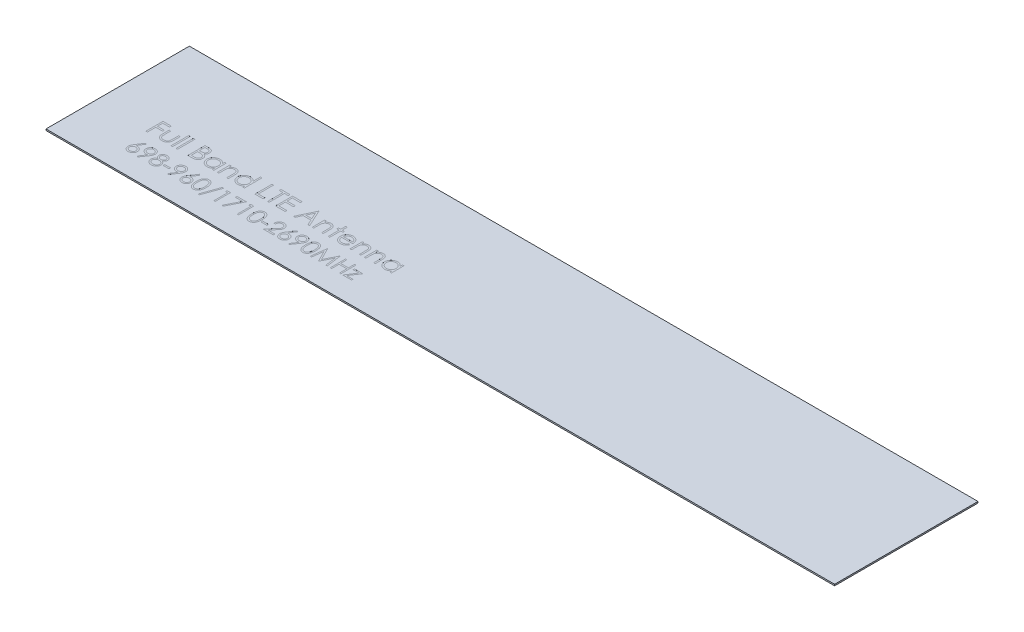
from build123d import *

# Parameters (mm, degrees)
IZIM1_W                     = 110
IZIM1_H                     = 20
Y_KSEKLIK_EKSTR_ZYON1_DEPTH = 0.2
IZIM2_W                     = 0.213701923
IZIM2_H                     = 2.442307692
IZIM2_W_2                   = 0.814102564
IZIM2_H_2                   = 0.217094017
KES_EKSTR_ZYON1_DEPTH       = 0.001


with BuildPart() as part:
    # Çizim1 → Yükseklik-Ekstrüzyon1 (new body)
    with BuildSketch(Plane(origin=(0, 0, 0), x_dir=(1, 0, 0), z_dir=(0, 1, 0))):
        Rectangle(IZIM1_W, IZIM1_H)
    extrude(amount=Y_KSEKLIK_EKSTR_ZYON1_DEPTH)

    # Çizim2 → Kes-Ekstrüzyon1 (cut)
    # profile 1 of 38: a face of its own
    with BuildSketch(Plane(origin=(0, 0.2, 0), x_dir=(1, 0, 0), z_dir=(0, 1, 0))):
        Polygon((-47.759154634, -0.921756753), (-46.599058481, -0.921756753), (-46.599058481, -1.165987522), (-47.545452711, -1.165987522), (-47.545452711, -1.89867983), (-46.599058481, -1.89867983), (-46.599058481, -2.142910599), (-47.545452711, -2.142910599), (-47.545452711, -3.303006753), (-47.759154634, -3.303006753), align=None)
    # profile 2 of 38: a face of its own
    with BuildSketch(Plane(origin=(0, 0.2, 0), x_dir=(1, 0, 0), z_dir=(0, 1, 0))):
        with BuildLine():
            Line((-46.263241173, -1.562862522), (-46.04953925, -1.562862522))
            Line((-46.04953925, -1.562862522), (-46.04953925, -2.369968892))
            add(Edge.make_bspline(
                [(-46.04953925, -2.369968892), (-46.049442704, -2.393660799), (-46.049258016, -2.438982305), (-46.048005518, -2.504198066), (-46.045059508, -2.563672651), (-46.041376174, -2.617440417), (-46.036639435, -2.665492267), (-46.031003792, -2.707660365), (-46.024704758, -2.744422908), (-46.018538876, -2.766564013), (-46.015671311, -2.77686117)],
                knots=[0, 0, 0, 0, 1.388932606, 2.656963016, 3.823490214, 4.879454478, 5.816252168, 6.653371382, 7.373723809, 8, 8, 8, 8], degree=3))
            add(Edge.make_bspline(
                [(-46.015671311, -2.77686117), (-46.011071107, -2.789803516), (-46.001966336, -2.81541914), (-45.985451698, -2.852423088), (-45.965021704, -2.886696272), (-45.942665286, -2.919560293), (-45.916880153, -2.950041644), (-45.887992549, -2.978088853), (-45.856969462, -3.004761637), (-45.810871848, -3.036319861), (-45.747830455, -3.070144041), (-45.665063134, -3.099328517), (-45.575321151, -3.116770031), (-45.513296583, -3.118793586), (-45.481416503, -3.119833676)],
                knots=[0, 0, 0, 0, 0.725840625, 1.436591201, 2.137033971, 2.831655856, 3.53531722, 4.242432219, 4.957935707, 5.694543706, 7.190802206, 8.724350549, 10.316345118, 12, 12, 12, 12], degree=3))
            add(Edge.make_bspline(
                [(-45.481416503, -3.119833676), (-45.449539385, -3.118771469), (-45.387863058, -3.116716296), (-45.299107088, -3.099854639), (-45.217973537, -3.071683982), (-45.145276729, -3.032354297), (-45.081346398, -2.984224429), (-45.028071427, -2.927748793), (-44.98411542, -2.864714121), (-44.964922939, -2.817684924), (-44.95527092, -2.794033646)],
                knots=[0, 0, 0, 0, 1.157059328, 2.238695713, 3.266970494, 4.264342957, 5.228770407, 6.160125903, 7.074715775, 8, 8, 8, 8], degree=3))
            add(Edge.make_bspline(
                [(-44.95527092, -2.794033646), (-44.952417346, -2.784531575), (-44.94610879, -2.763524817), (-44.939330833, -2.727887881), (-44.933224994, -2.685389641), (-44.928011297, -2.635752002), (-44.924293035, -2.579104683), (-44.922288685, -2.515465384), (-44.920024269, -2.445033887), (-44.9199899, -2.39572993), (-44.919971942, -2.369968892)],
                knots=[0, 0, 0, 0, 0.557542046, 1.232589297, 2.036731608, 2.971723315, 4.038036528, 5.22795436, 6.551621927, 8, 8, 8, 8], degree=3))
            Line((-44.919971942, -2.369968892), (-44.919971942, -1.562862522))
            Line((-44.919971942, -1.562862522), (-44.706270019, -1.562862522))
            Line((-44.706270019, -1.562862522), (-44.706270019, -2.410038003))
            add(Edge.make_bspline(
                [(-44.706270019, -2.410038003), (-44.706570529, -2.438821989), (-44.70715356, -2.49466686), (-44.710900521, -2.575822657), (-44.717329632, -2.651452685), (-44.72708778, -2.721596975), (-44.738562463, -2.786201976), (-44.753364498, -2.845350489), (-44.771038978, -2.898860275), (-44.790977194, -2.947670305), (-44.814532429, -2.991925424), (-44.839587956, -3.033927828), (-44.868519988, -3.072635343), (-44.898979737, -3.109974797), (-44.932862649, -3.144088943), (-44.969533803, -3.175760572), (-45.008477051, -3.205473831), (-45.050556595, -3.232069862), (-45.09515813, -3.256029759), (-45.142336719, -3.27726784), (-45.192670219, -3.294074415), (-45.245509229, -3.308573279), (-45.301112628, -3.319945087), (-45.359426809, -3.327964162), (-45.420432132, -3.332879968), (-45.462008389, -3.333313386), (-45.483324556, -3.333535599)],
                knots=[0, 0, 0, 0, 1.493040784, 2.896703357, 4.213163133, 5.428574705, 6.569057535, 7.615249723, 8.588095153, 9.490268104, 10.346124644, 11.18633936, 12.024365274, 12.850166724, 13.684164916, 14.514361689, 15.362232829, 16.222528818, 17.093394965, 17.986930858, 18.902426812, 19.842810585, 20.827885679, 21.843828298, 22.894529745, 24, 24, 24, 24], degree=3))
            add(Edge.make_bspline(
                [(-45.483324556, -3.333535599), (-45.504481292, -3.333304477), (-45.546056247, -3.3328503), (-45.607064718, -3.327991321), (-45.665540466, -3.319957547), (-45.721275595, -3.30848998), (-45.774326033, -3.294175898), (-45.824906667, -3.277164564), (-45.872425234, -3.256018737), (-45.917452634, -3.232221505), (-45.959636401, -3.205302988), (-45.999170987, -3.175797232), (-46.036003382, -3.143748286), (-46.070141708, -3.109289994), (-46.101106787, -3.0719949), (-46.129284487, -3.03216301), (-46.155108602, -2.990188996), (-46.178480769, -2.945242452), (-46.198559302, -2.895867567), (-46.216286175, -2.841236863), (-46.23078502, -2.780751401), (-46.242584092, -2.714462892), (-46.252076054, -2.642688587), (-46.258666091, -2.56501329), (-46.26235079, -2.481626207), (-46.26293798, -2.42403405), (-46.263241173, -2.394296567)],
                knots=[0, 0, 0, 0, 1.083640291, 2.129454052, 3.13281866, 4.105697902, 5.042300162, 5.946461698, 6.836384745, 7.703652036, 8.553297018, 9.397182691, 10.228592656, 11.052265423, 11.879314572, 12.708807002, 13.549817954, 14.402308542, 15.300838682, 16.27712199, 17.341985831, 18.484375296, 19.725102775, 21.0496083, 22.476576903, 24, 24, 24, 24], degree=3))
            Line((-46.263241173, -2.394296567), (-46.263241173, -1.562862522))
        make_face()
    # profile 3 of 38: a face of its own
    with BuildSketch(Plane(origin=(0, 0.2, 0), x_dir=(1, 0, 0), z_dir=(0, 1, 0))):
        with Locations((-44.141486366, -2.081852907)):
            Rectangle(IZIM2_W, IZIM2_H)
    # profile 4 of 38: a face of its own
    with BuildSketch(Plane(origin=(0, 0.2, 0), x_dir=(1, 0, 0), z_dir=(0, 1, 0))):
        with Locations((-43.46985175, -2.081852907)):
            Rectangle(IZIM2_W, IZIM2_H)
    # profile 5 of 38: a face of its own
    with BuildSketch(Plane(origin=(0, 0.2, 0), x_dir=(1, 0, 0), z_dir=(0, 1, 0))):
        with BuildLine():
            Line((-41.897616173, -0.921756753), (-41.433005295, -0.921756753))
            add(Edge.make_bspline(
                [(-41.433005295, -0.921756753), (-41.410261992, -0.921876326), (-41.366179808, -0.922108088), (-41.302076938, -0.925702504), (-41.242036229, -0.930603573), (-41.18604027, -0.938380118), (-41.134114935, -0.947763452), (-41.086103739, -0.959126652), (-41.042159354, -0.972751901), (-40.989695153, -0.994418746), (-40.929877703, -1.026615402), (-40.865108797, -1.074191801), (-40.809724841, -1.132384423), (-40.761973079, -1.198027087), (-40.724008388, -1.270237317), (-40.696542849, -1.347294015), (-40.679154366, -1.428203272), (-40.677366092, -1.483749791), (-40.676462327, -1.511822108)],
                knots=[0, 0, 0, 0, 1.001505555, 1.941167018, 2.826882275, 3.653841531, 4.429895133, 5.150066043, 5.825578002, 6.45369114, 7.647487171, 8.808567382, 9.977351308, 11.170798116, 12.373658725, 13.556498008, 14.765093433, 16, 16, 16, 16], degree=3))
            add(Edge.make_bspline(
                [(-40.676462327, -1.511822108), (-40.677206106, -1.53811965), (-40.678667702, -1.589796801), (-40.692644115, -1.665380471), (-40.714524855, -1.737329069), (-40.744940391, -1.805380013), (-40.784470499, -1.867995739), (-40.831318748, -1.925681361), (-40.887840644, -1.975994491), (-40.930188277, -2.00412243), (-40.951698955, -2.018410148)],
                knots=[0, 0, 0, 0, 1.044552857, 2.05264487, 3.044412934, 4.028983338, 5.005914585, 5.980388656, 6.974128949, 8, 8, 8, 8], degree=3))
            add(Edge.make_bspline(
                [(-40.951698955, -2.018410148), (-40.924647664, -2.0287958), (-40.872891844, -2.048666123), (-40.801667967, -2.083796679), (-40.74030326, -2.122006972), (-40.688325916, -2.163734535), (-40.643872976, -2.208712136), (-40.6050566, -2.257599277), (-40.571935879, -2.311033682), (-40.543556194, -2.36845823), (-40.521411415, -2.429286559), (-40.504827094, -2.492948105), (-40.495324241, -2.559214588), (-40.493971935, -2.604312319), (-40.49328925, -2.627079019)],
                knots=[0, 0, 0, 0, 1.27268992, 2.434971085, 3.483601985, 4.442670788, 5.356604649, 6.2567628, 7.179492994, 8.113709626, 9.066344395, 10.018646069, 10.999752585, 12, 12, 12, 12], degree=3))
            add(Edge.make_bspline(
                [(-40.49328925, -2.627079019), (-40.493953854, -2.650324694), (-40.495261481, -2.696061212), (-40.504908926, -2.763249973), (-40.521243694, -2.827458642), (-40.543743884, -2.889102525), (-40.573109674, -2.948062367), (-40.608847449, -3.004404963), (-40.651459281, -3.057564212), (-40.699127054, -3.10813082), (-40.753053621, -3.153597583), (-40.811234876, -3.194089519), (-40.874403533, -3.227390322), (-40.941522122, -3.255363901), (-41.013343558, -3.276732013), (-41.089545332, -3.29168121), (-41.170061723, -3.301753923), (-41.225313357, -3.302582057), (-41.253648324, -3.303006753)],
                knots=[0, 0, 0, 0, 0.978564426, 1.925352924, 2.850884081, 3.763762016, 4.682927383, 5.618979971, 6.567305752, 7.547517671, 8.540179244, 9.531824382, 10.526200242, 11.540722885, 12.589160233, 13.674978461, 14.80764778, 16, 16, 16, 16], degree=3))
            Line((-41.253648324, -3.303006753), (-41.897616173, -3.303006753))
            Line((-41.897616173, -3.303006753), (-41.897616173, -0.921756753))
        make_face()
        with BuildLine():
            Line((-41.68391425, -1.165987522), (-41.68391425, -1.929208676))
            Line((-41.68391425, -1.929208676), (-41.54033327, -1.929208676))
            add(Edge.make_bspline(
                [(-41.54033327, -1.929208676), (-41.519345072, -1.928936586), (-41.478791596, -1.928410851), (-41.420063238, -1.926904869), (-41.365549609, -1.922687986), (-41.315344808, -1.918472315), (-41.269527896, -1.911617997), (-41.228200376, -1.903459071), (-41.190713652, -1.894830166), (-41.147484068, -1.880155211), (-41.098448723, -1.858467007), (-41.046174771, -1.82480849), (-41.000091141, -1.784718886), (-40.961176626, -1.738460749), (-40.929328108, -1.687525005), (-40.907207169, -1.632724359), (-40.892207142, -1.575424591), (-40.890852189, -1.53608753), (-40.89016425, -1.516115227)],
                knots=[0, 0, 0, 0, 1.156816544, 2.235205308, 3.236616184, 4.169592532, 5.011045266, 5.787822928, 6.49130361, 7.128639758, 8.301311294, 9.436451833, 10.541879658, 11.654887649, 12.756523258, 13.837046038, 14.901820046, 16, 16, 16, 16], degree=3))
            add(Edge.make_bspline(
                [(-40.89016425, -1.516115227), (-40.89052224, -1.502898764), (-40.891224478, -1.47697323), (-40.896975742, -1.43917983), (-40.906750824, -1.40363542), (-40.919306335, -1.369852891), (-40.936851853, -1.338888579), (-40.957509852, -1.309671869), (-40.982469224, -1.283197731), (-41.01087911, -1.258453483), (-41.043542119, -1.236515688), (-41.080438766, -1.217301883), (-41.122068239, -1.201830034), (-41.167728949, -1.188279937), (-41.218123743, -1.178762901), (-41.272671073, -1.170834436), (-41.33181773, -1.166798052), (-41.37273788, -1.166263725), (-41.393890211, -1.165987522)],
                knots=[0, 0, 0, 0, 0.91205012, 1.789085906, 2.630437955, 3.453916878, 4.269457761, 5.079663411, 5.91843418, 6.774407191, 7.675494373, 8.627863946, 9.638891023, 10.736472738, 11.911756761, 13.175263542, 14.539845004, 16, 16, 16, 16], degree=3))
            Line((-41.393890211, -1.165987522), (-41.68391425, -1.165987522))
        make_face(mode=Mode.SUBTRACT)
        with BuildLine():
            Line((-41.68391425, -2.173439445), (-41.68391425, -3.058775984))
            Line((-41.68391425, -3.058775984), (-41.379579815, -3.058775984))
            add(Edge.make_bspline(
                [(-41.379579815, -3.058775984), (-41.35779551, -3.058514899), (-41.315809134, -3.058011691), (-41.255188475, -3.056368932), (-41.199002471, -3.052632223), (-41.147507507, -3.046749957), (-41.100147539, -3.040369262), (-41.057490708, -3.031789087), (-41.019191232, -3.021958634), (-40.974781391, -3.00676342), (-40.924772754, -2.983157428), (-40.870881082, -2.947565071), (-40.822966101, -2.905162963), (-40.782277166, -2.85608818), (-40.748930829, -2.802726867), (-40.724672386, -2.746158334), (-40.709710749, -2.687317288), (-40.707899523, -2.647198864), (-40.706991173, -2.627079019)],
                knots=[0, 0, 0, 0, 1.160039823, 2.235823828, 3.228722157, 4.157150951, 4.99529583, 5.772374946, 6.472645482, 7.099169577, 8.269452708, 9.405989375, 10.527446681, 11.663510218, 12.788923519, 13.866172445, 14.929861265, 16, 16, 16, 16], degree=3))
            add(Edge.make_bspline(
                [(-40.706991173, -2.627079019), (-40.707179022, -2.614496942), (-40.707551692, -2.58953574), (-40.71317186, -2.552853727), (-40.721345582, -2.517321481), (-40.731912504, -2.482842518), (-40.74730182, -2.450040203), (-40.765267702, -2.418265783), (-40.786332512, -2.387477255), (-40.819155775, -2.34855249), (-40.866897786, -2.30370538), (-40.934734003, -2.259796829), (-41.011867656, -2.224385732), (-41.067811718, -2.209350195), (-41.096710975, -2.201583225)],
                knots=[0, 0, 0, 0, 0.723448775, 1.435228256, 2.130040452, 2.821711965, 3.505591119, 4.210454504, 4.921174351, 5.648778258, 7.137944449, 8.670945889, 10.280296675, 12, 12, 12, 12], degree=3))
            add(Edge.make_bspline(
                [(-41.096710975, -2.201583225), (-41.108296842, -2.199232534), (-41.133417391, -2.194135751), (-41.174380048, -2.188755689), (-41.221144988, -2.183962532), (-41.273820195, -2.180417084), (-41.332472316, -2.17675231), (-41.397226612, -2.175327084), (-41.467818642, -2.173626694), (-41.516799167, -2.173503458), (-41.542241323, -2.173439445)],
                knots=[0, 0, 0, 0, 0.634451884, 1.375622551, 2.216452059, 3.157844607, 4.20941857, 5.370758133, 6.634282058, 8, 8, 8, 8], degree=3))
            Line((-41.542241323, -2.173439445), (-41.68391425, -2.173439445))
        make_face(mode=Mode.SUBTRACT)
    # profile 6 of 38: a face of its own
    with BuildSketch(Plane(origin=(0, 0.2, 0), x_dir=(1, 0, 0), z_dir=(0, 1, 0))):
        with BuildLine():
            Line((-38.295212327, -1.562862522), (-38.295212327, -3.303006753))
            Line((-38.295212327, -3.303006753), (-38.50891425, -3.303006753))
            Line((-38.50891425, -3.303006753), (-38.50891425, -3.00201141))
            add(Edge.make_bspline(
                [(-38.50891425, -3.00201141), (-38.533011677, -3.029252634), (-38.580038109, -3.082414225), (-38.658579298, -3.15186656), (-38.741833362, -3.209273954), (-38.829396225, -3.255640236), (-38.921188816, -3.290469117), (-39.017007654, -3.3152247), (-39.116891826, -3.331140863), (-39.185099231, -3.332730192), (-39.219663949, -3.333535599)],
                knots=[0, 0, 0, 0, 1.074387032, 2.096679803, 3.090159297, 4.057316773, 5.018401886, 5.985159533, 6.978961417, 8, 8, 8, 8], degree=3))
            add(Edge.make_bspline(
                [(-39.219663949, -3.333535599), (-39.250394289, -3.332701228), (-39.310995881, -3.331055811), (-39.400142449, -3.318290744), (-39.485930212, -3.29779116), (-39.568440233, -3.269283591), (-39.647138604, -3.231468782), (-39.722699134, -3.186196968), (-39.794730376, -3.132284904), (-39.862134405, -3.070652692), (-39.924204748, -3.003708959), (-39.978675007, -2.932308507), (-40.024090942, -2.856760082), (-40.062068532, -2.778020204), (-40.091321402, -2.695482732), (-40.111714179, -2.609433088), (-40.124464375, -2.519973013), (-40.126109112, -2.459054159), (-40.126943096, -2.428164505)],
                knots=[0, 0, 0, 0, 1.033919861, 2.038935746, 3.024066025, 3.998881131, 4.97069526, 5.957263378, 6.95902576, 7.993208707, 9.027059324, 10.027763471, 11.009749337, 11.988697705, 12.965288445, 13.950418724, 14.960734635, 16, 16, 16, 16], degree=3))
            add(Edge.make_bspline(
                [(-40.126943096, -2.428164505), (-40.126090628, -2.397913307), (-40.124405345, -2.33810832), (-40.111850565, -2.250152634), (-40.090738396, -2.165435746), (-40.061110307, -2.084230397), (-40.023117834, -2.006438328), (-39.976902475, -1.932004518), (-39.922460892, -1.86072391), (-39.859696308, -1.794272593), (-39.791704973, -1.732890354), (-39.718968854, -1.679544199), (-39.643297301, -1.633472558), (-39.563516574, -1.596969032), (-39.480807526, -1.567435338), (-39.394433842, -1.547002193), (-39.304754893, -1.534961694), (-39.243869397, -1.533218099), (-39.212985764, -1.532333676)],
                knots=[0, 0, 0, 0, 1.020392517, 2.01726096, 2.990465484, 3.961182959, 4.928053699, 5.906110375, 6.912531644, 7.948652711, 8.985773172, 9.998621852, 10.987621588, 11.969261332, 12.953316658, 13.946091881, 14.958173133, 16, 16, 16, 16], degree=3))
            add(Edge.make_bspline(
                [(-39.212985764, -1.532333676), (-39.177471217, -1.533311861), (-39.107828867, -1.535230034), (-39.005960346, -1.551193068), (-38.909591514, -1.578161383), (-38.817978464, -1.614844538), (-38.731450175, -1.663591262), (-38.650825824, -1.725081914), (-38.575261629, -1.798928686), (-38.531460037, -1.855650364), (-38.50891425, -1.884846447)],
                knots=[0, 0, 0, 0, 1.038897134, 2.037228247, 3.008116434, 3.962042015, 4.918381754, 5.904844433, 6.921570401, 8, 8, 8, 8], degree=3))
            Line((-38.50891425, -1.884846447), (-38.50891425, -1.562862522))
            Line((-38.50891425, -1.562862522), (-38.295212327, -1.562862522))
        make_face()
        with BuildLine():
            add(Edge.make_bspline(
                [(-39.210123685, -1.746035599), (-39.241361833, -1.747147056), (-39.303020968, -1.749340896), (-39.393538405, -1.766467863), (-39.480156995, -1.794964346), (-39.562443521, -1.833936497), (-39.639098147, -1.882941762), (-39.707605805, -1.942215418), (-39.768526822, -2.010140243), (-39.819763337, -2.086409715), (-39.8615308, -2.168173737), (-39.890899799, -2.253643221), (-39.910269054, -2.341276608), (-39.912247887, -2.400714435), (-39.913241173, -2.430549572)],
                knots=[0, 0, 0, 0, 1.031046209, 2.035121221, 3.029706178, 4.034933723, 5.034054252, 6.02443088, 7.017295772, 8.038157696, 9.050218397, 10.03989886, 11.016116709, 12, 12, 12, 12], degree=3))
            add(Edge.make_bspline(
                [(-39.913241173, -2.430549572), (-39.911972379, -2.460206412), (-39.909439766, -2.519403849), (-39.89123974, -2.607156706), (-39.860705397, -2.692646331), (-39.819038922, -2.775147114), (-39.766864629, -2.851744511), (-39.7063886, -2.92096413), (-39.637025998, -2.980488296), (-39.560194962, -3.030316003), (-39.478138467, -3.070567646), (-39.391846096, -3.098574983), (-39.302939992, -3.116657366), (-39.242488672, -3.118769519), (-39.212031738, -3.119833676)],
                knots=[0, 0, 0, 0, 0.979072187, 1.954306742, 2.945804271, 3.96968567, 4.997920485, 5.998718438, 6.996577872, 8.005894225, 9.015743152, 10.005417472, 10.995077863, 12, 12, 12, 12], degree=3))
            add(Edge.make_bspline(
                [(-39.212031738, -3.119833676), (-39.181111885, -3.118704308), (-39.119615365, -3.116458106), (-39.028829387, -3.099257817), (-38.940726564, -3.070840117), (-38.856507039, -3.031448032), (-38.778050885, -2.982627402), (-38.707635365, -2.925472578), (-38.648093251, -2.858999519), (-38.597615779, -2.785945182), (-38.558035718, -2.705858984), (-38.529204864, -2.620586972), (-38.51215926, -2.530126178), (-38.510010876, -2.468306256), (-38.50891425, -2.436750743)],
                knots=[0, 0, 0, 0, 1.01762866, 2.023962475, 3.030623092, 4.058876274, 5.077231937, 6.066672613, 7.034107872, 8.005628644, 8.981990164, 9.965428785, 10.961468474, 12, 12, 12, 12], degree=3))
            add(Edge.make_bspline(
                [(-38.50891425, -2.436750743), (-38.509567159, -2.412708398), (-38.510852291, -2.365385454), (-38.520670232, -2.295902268), (-38.53628778, -2.229408429), (-38.558294728, -2.165834028), (-38.587203976, -2.105530562), (-38.62207076, -2.04806504), (-38.663508218, -1.993736337), (-38.710849302, -1.943292569), (-38.762668842, -1.897282423), (-38.817501913, -1.85621318), (-38.875998168, -1.822475104), (-38.937173866, -1.794552382), (-39.001135149, -1.772332496), (-39.068402481, -1.757509083), (-39.138260864, -1.747330722), (-39.185917198, -1.746471852), (-39.210123685, -1.746035599)],
                knots=[0, 0, 0, 0, 1.050140795, 2.067009409, 3.05949893, 4.030605086, 5.00011959, 5.97591094, 6.962425594, 7.979863591, 8.993523472, 9.986985069, 10.967611495, 11.937549037, 12.921786183, 13.919465291, 14.943216303, 16, 16, 16, 16], degree=3))
        make_face(mode=Mode.SUBTRACT)
    # profile 7 of 38: a face of its own
    with BuildSketch(Plane(origin=(0, 0.2, 0), x_dir=(1, 0, 0), z_dir=(0, 1, 0))):
        with BuildLine():
            Line((-37.806750788, -1.562862522), (-37.593048865, -1.562862522))
            Line((-37.593048865, -1.562862522), (-37.593048865, -1.876737222))
            add(Edge.make_bspline(
                [(-37.593048865, -1.876737222), (-37.570231296, -1.848269226), (-37.525953006, -1.793026088), (-37.45221295, -1.720417983), (-37.37428219, -1.660583821), (-37.292637969, -1.612888204), (-37.207169457, -1.576933624), (-37.118397634, -1.550967161), (-37.025791022, -1.535397304), (-36.962814146, -1.53336288), (-36.930954514, -1.532333676)],
                knots=[0, 0, 0, 0, 1.12780773, 2.188550248, 3.19190651, 4.159438251, 5.104880172, 6.052711206, 7.014878035, 8, 8, 8, 8], degree=3))
            add(Edge.make_bspline(
                [(-36.930954514, -1.532333676), (-36.898752779, -1.533521032), (-36.835726216, -1.535844975), (-36.743960964, -1.554225974), (-36.658254066, -1.585621227), (-36.578911118, -1.628628011), (-36.507387067, -1.682108487), (-36.444573195, -1.744414085), (-36.392618914, -1.816080241), (-36.357786423, -1.882566889), (-36.334840937, -1.941546229), (-36.320395365, -1.992060536), (-36.308127858, -2.048338421), (-36.297492687, -2.11020982), (-36.290296473, -2.178108231), (-36.284620735, -2.251755322), (-36.280553088, -2.331127236), (-36.280391702, -2.386022959), (-36.280308481, -2.414331122)],
                knots=[0, 0, 0, 0, 1.235846778, 2.418850247, 3.575807741, 4.728682307, 5.871620074, 6.994088408, 8.11269785, 9.256955736, 9.865816715, 10.540099792, 11.271859618, 12.076849838, 12.949306005, 13.892391288, 14.913166135, 16, 16, 16, 16], degree=3))
            Line((-36.280308481, -2.414331122), (-36.280308481, -3.303006753))
            Line((-36.280308481, -3.303006753), (-36.494010404, -3.303006753))
            Line((-36.494010404, -3.303006753), (-36.494010404, -2.484452066))
            add(Edge.make_bspline(
                [(-36.494010404, -2.484452066), (-36.494141854, -2.460760366), (-36.494393296, -2.415442178), (-36.495186353, -2.350557182), (-36.497098025, -2.29171542), (-36.499784287, -2.239057569), (-36.503716092, -2.192634191), (-36.507813632, -2.152350736), (-36.512824447, -2.118258351), (-36.517289572, -2.097735322), (-36.519292104, -2.088531092)],
                knots=[0, 0, 0, 0, 1.430800155, 2.736877192, 3.918605307, 4.986035426, 5.920637409, 6.731861385, 7.431261377, 8, 8, 8, 8], degree=3))
            add(Edge.make_bspline(
                [(-36.519292104, -2.088531092), (-36.526521261, -2.061513304), (-36.54043515, -2.00951242), (-36.574816306, -1.938976834), (-36.61823274, -1.878970567), (-36.671231098, -1.829864619), (-36.733299451, -1.791648389), (-36.804265561, -1.76513218), (-36.8834446, -1.748547611), (-36.939134814, -1.746896295), (-36.968161545, -1.746035599)],
                knots=[0, 0, 0, 0, 1.084156227, 2.086665306, 3.027808233, 3.945421172, 4.874247719, 5.839848303, 6.874090471, 8, 8, 8, 8], degree=3))
            add(Edge.make_bspline(
                [(-36.968161545, -1.746035599), (-36.985352595, -1.746359452), (-37.019373236, -1.747000349), (-37.069821699, -1.753430608), (-37.118755824, -1.763947878), (-37.166666717, -1.778146005), (-37.212596126, -1.797646584), (-37.258019689, -1.819778174), (-37.301226969, -1.847365439), (-37.34313928, -1.878111202), (-37.382132459, -1.912182948), (-37.418414774, -1.948136088), (-37.450757606, -1.986423597), (-37.480059687, -2.026428561), (-37.505354184, -2.068700401), (-37.527433874, -2.112831295), (-37.546167981, -2.158879329), (-37.555477098, -2.190839147), (-37.560134953, -2.206830371)],
                knots=[0, 0, 0, 0, 1.023777757, 2.026029729, 3.023749952, 4.003683103, 4.997618607, 5.993177895, 7.010360494, 8.046726602, 9.087585522, 10.09234134, 11.086953743, 12.070360549, 13.043493632, 14.017870808, 15.008233677, 16, 16, 16, 16], degree=3))
            add(Edge.make_bspline(
                [(-37.560134953, -2.206830371), (-37.562815321, -2.218570071), (-37.568650342, -2.244126786), (-37.574952613, -2.286067007), (-37.580672767, -2.334583258), (-37.585460412, -2.389618923), (-37.588389632, -2.451366692), (-37.591583499, -2.51956286), (-37.592746271, -2.594479358), (-37.592945176, -2.646636689), (-37.593048865, -2.673826314)],
                knots=[0, 0, 0, 0, 0.615963638, 1.340920617, 2.168419149, 3.115676021, 4.16674242, 5.331190069, 6.6087489, 8, 8, 8, 8], degree=3))
            Line((-37.593048865, -2.673826314), (-37.593048865, -3.303006753))
            Line((-37.593048865, -3.303006753), (-37.806750788, -3.303006753))
            Line((-37.806750788, -3.303006753), (-37.806750788, -1.562862522))
        make_face()
    # profile 8 of 38: a face of its own
    with BuildSketch(Plane(origin=(0, 0.2, 0), x_dir=(1, 0, 0), z_dir=(0, 1, 0))):
        with BuildLine():
            Line((-34.021173865, -0.860699061), (-34.021173865, -3.303006753))
            Line((-34.021173865, -3.303006753), (-34.234875788, -3.303006753))
            Line((-34.234875788, -3.303006753), (-34.234875788, -3.00201141))
            add(Edge.make_bspline(
                [(-34.234875788, -3.00201141), (-34.258973215, -3.029252634), (-34.305999648, -3.082414225), (-34.384540837, -3.15186656), (-34.467794901, -3.209273954), (-34.555357764, -3.255640236), (-34.647150354, -3.290469117), (-34.742969192, -3.3152247), (-34.842853364, -3.331140863), (-34.91106077, -3.332730192), (-34.945625488, -3.333535599)],
                knots=[0, 0, 0, 0, 1.074387032, 2.096679803, 3.090159297, 4.057316773, 5.018401886, 5.985159533, 6.978961417, 8, 8, 8, 8], degree=3))
            add(Edge.make_bspline(
                [(-34.945625488, -3.333535599), (-34.976355828, -3.332701228), (-35.036957419, -3.331055811), (-35.126103988, -3.318290744), (-35.21189175, -3.29779116), (-35.294401772, -3.269283591), (-35.373100142, -3.231468782), (-35.448660672, -3.186196968), (-35.520691915, -3.132284904), (-35.588095944, -3.070652692), (-35.650166287, -3.003708959), (-35.704636546, -2.932308507), (-35.75005248, -2.856760082), (-35.788030071, -2.778020204), (-35.817282941, -2.695482732), (-35.837675717, -2.609433088), (-35.850425914, -2.519973013), (-35.852070651, -2.459054159), (-35.852904634, -2.428164505)],
                knots=[0, 0, 0, 0, 1.033919861, 2.038935746, 3.024066025, 3.998881131, 4.97069526, 5.957263378, 6.95902576, 7.993208707, 9.027059324, 10.027763471, 11.009749337, 11.988697705, 12.965288445, 13.950418724, 14.960734635, 16, 16, 16, 16], degree=3))
            add(Edge.make_bspline(
                [(-35.852904634, -2.428164505), (-35.852052166, -2.397913307), (-35.850366883, -2.33810832), (-35.837812103, -2.250152634), (-35.816699935, -2.165435746), (-35.787071846, -2.084230397), (-35.749079373, -2.006438328), (-35.702864013, -1.932004518), (-35.64842243, -1.86072391), (-35.585657846, -1.794272593), (-35.517666512, -1.732890354), (-35.444930393, -1.679544199), (-35.369258839, -1.633472558), (-35.289478112, -1.596969032), (-35.206769064, -1.567435338), (-35.12039538, -1.547002193), (-35.030716431, -1.534961694), (-34.969830936, -1.533218099), (-34.938947303, -1.532333676)],
                knots=[0, 0, 0, 0, 1.020392517, 2.01726096, 2.990465484, 3.961182959, 4.928053699, 5.906110375, 6.912531644, 7.948652711, 8.985773172, 9.998621852, 10.987621588, 11.969261332, 12.953316658, 13.946091881, 14.958173133, 16, 16, 16, 16], degree=3))
            add(Edge.make_bspline(
                [(-34.938947303, -1.532333676), (-34.903421225, -1.533399861), (-34.833687481, -1.535492664), (-34.731702951, -1.552982174), (-34.635236738, -1.582348346), (-34.543733473, -1.622551522), (-34.457738671, -1.674803461), (-34.376621974, -1.737907571), (-34.301794035, -1.81364979), (-34.257521955, -1.870535522), (-34.234875788, -1.899633856)],
                knots=[0, 0, 0, 0, 1.031072012, 2.023879775, 2.993683497, 3.952812103, 4.918022106, 5.908088563, 6.929940113, 8, 8, 8, 8], degree=3))
            Line((-34.234875788, -1.899633856), (-34.234875788, -0.860699061))
            Line((-34.234875788, -0.860699061), (-34.021173865, -0.860699061))
        make_face()
        with BuildLine():
            add(Edge.make_bspline(
                [(-34.936085223, -1.746035599), (-34.967323371, -1.747147056), (-35.028982506, -1.749340896), (-35.119499943, -1.766467863), (-35.206118534, -1.794964346), (-35.288405059, -1.833936497), (-35.365059685, -1.882941762), (-35.433567344, -1.942215418), (-35.49448836, -2.010140243), (-35.545724875, -2.086409715), (-35.587492339, -2.168173737), (-35.616861337, -2.253643221), (-35.636230593, -2.341276608), (-35.638209426, -2.400714435), (-35.639202711, -2.430549572)],
                knots=[0, 0, 0, 0, 1.031046209, 2.035121221, 3.029706178, 4.034933723, 5.034054252, 6.02443088, 7.017295772, 8.038157696, 9.050218397, 10.03989886, 11.016116709, 12, 12, 12, 12], degree=3))
            add(Edge.make_bspline(
                [(-35.639202711, -2.430549572), (-35.637933918, -2.460206412), (-35.635401304, -2.519403849), (-35.617201278, -2.607156706), (-35.586666936, -2.692646331), (-35.545000461, -2.775147114), (-35.492826168, -2.851744511), (-35.432350138, -2.92096413), (-35.362987536, -2.980488296), (-35.2861565, -3.030316003), (-35.204100006, -3.070567646), (-35.117807635, -3.098574983), (-35.028901531, -3.116657366), (-34.968450211, -3.118769519), (-34.937993276, -3.119833676)],
                knots=[0, 0, 0, 0, 0.979072187, 1.954306742, 2.945804271, 3.96968567, 4.997920485, 5.998718438, 6.996577872, 8.005894225, 9.015743152, 10.005417472, 10.995077863, 12, 12, 12, 12], degree=3))
            add(Edge.make_bspline(
                [(-34.937993276, -3.119833676), (-34.907073423, -3.118704308), (-34.845576903, -3.116458106), (-34.754790925, -3.099257817), (-34.666688102, -3.070840117), (-34.582468577, -3.031448032), (-34.504012424, -2.982627402), (-34.433596903, -2.925472578), (-34.374054789, -2.858999519), (-34.323577317, -2.785945182), (-34.283997257, -2.705858984), (-34.255166402, -2.620586972), (-34.238120799, -2.530126178), (-34.235972415, -2.468306256), (-34.234875788, -2.436750743)],
                knots=[0, 0, 0, 0, 1.01762866, 2.023962475, 3.030623092, 4.058876274, 5.077231937, 6.066672613, 7.034107872, 8.005628644, 8.981990164, 9.965428785, 10.961468474, 12, 12, 12, 12], degree=3))
            add(Edge.make_bspline(
                [(-34.234875788, -2.436750743), (-34.235528697, -2.412708398), (-34.236813829, -2.365385454), (-34.24663177, -2.295902268), (-34.262249318, -2.229408429), (-34.284256266, -2.165834028), (-34.313165515, -2.105530562), (-34.348032298, -2.04806504), (-34.389469756, -1.993736337), (-34.436810841, -1.943292569), (-34.48863038, -1.897282423), (-34.543463452, -1.85621318), (-34.601959706, -1.822475104), (-34.663135404, -1.794552382), (-34.727096687, -1.772332496), (-34.79436402, -1.757509083), (-34.864222402, -1.747330722), (-34.911878736, -1.746471852), (-34.936085223, -1.746035599)],
                knots=[0, 0, 0, 0, 1.050140795, 2.067009409, 3.05949893, 4.030605086, 5.00011959, 5.97591094, 6.962425594, 7.979863591, 8.993523472, 9.986985069, 10.967611495, 11.937549037, 12.921786183, 13.919465291, 14.943216303, 16, 16, 16, 16], degree=3))
        make_face(mode=Mode.SUBTRACT)
    # profile 9 of 38: a face of its own
    with BuildSketch(Plane(origin=(0, 0.2, 0), x_dir=(1, 0, 0), z_dir=(0, 1, 0))):
        Polygon((-32.55578925, -0.921756753), (-32.342087327, -0.921756753), (-32.342087327, -3.058775984), (-31.426221942, -3.058775984), (-31.426221942, -3.303006753), (-32.55578925, -3.303006753), align=None)
    # profile 10 of 38: a face of its own
    with BuildSketch(Plane(origin=(0, 0.2, 0), x_dir=(1, 0, 0), z_dir=(0, 1, 0))):
        Polygon((-31.304106558, -1.165987522), (-31.304106558, -0.921756753), (-30.052423865, -0.921756753), (-30.052423865, -1.165987522), (-30.57141425, -1.165987522), (-30.57141425, -3.303006753), (-30.785116173, -3.303006753), (-30.785116173, -1.165987522), align=None)
    # profile 11 of 38: a face of its own
    with BuildSketch(Plane(origin=(0, 0.2, 0), x_dir=(1, 0, 0), z_dir=(0, 1, 0))):
        Polygon((-29.686077711, -0.921756753), (-28.342808481, -0.921756753), (-28.342808481, -1.165987522), (-29.472375788, -1.165987522), (-29.472375788, -1.89867983), (-28.342808481, -1.89867983), (-28.342808481, -2.142910599), (-29.472375788, -2.142910599), (-29.472375788, -3.058775984), (-28.342808481, -3.058775984), (-28.342808481, -3.303006753), (-29.686077711, -3.303006753), align=None)
    # profile 12 of 38: a face of its own
    with BuildSketch(Plane(origin=(0, 0.2, 0), x_dir=(1, 0, 0), z_dir=(0, 1, 0))):
        Polygon((-26.022616173, -0.921756753), (-24.923577711, -3.303006753), (-25.15588315, -3.303006753), (-25.507918907, -2.539785599), (-26.587399827, -2.539785599), (-26.948975848, -3.303006753), (-27.182712327, -3.303006753), (-26.053145019, -0.921756753), align=None)
        Polygon((-26.040265662, -1.38636763), (-26.471008601, -2.29555483), (-25.620494027, -2.29555483), align=None, mode=Mode.SUBTRACT)
    # profile 13 of 38: a face of its own
    with BuildSketch(Plane(origin=(0, 0.2, 0), x_dir=(1, 0, 0), z_dir=(0, 1, 0))):
        with BuildLine():
            Line((-24.557231558, -1.562862522), (-24.343529634, -1.562862522))
            Line((-24.343529634, -1.562862522), (-24.343529634, -1.876737222))
            add(Edge.make_bspline(
                [(-24.343529634, -1.876737222), (-24.320712065, -1.848269226), (-24.276433775, -1.793026088), (-24.20269372, -1.720417983), (-24.124762959, -1.660583821), (-24.043118739, -1.612888204), (-23.957650226, -1.576933624), (-23.868878403, -1.550967161), (-23.776271791, -1.535397304), (-23.713294915, -1.53336288), (-23.681435283, -1.532333676)],
                knots=[0, 0, 0, 0, 1.12780773, 2.188550248, 3.19190651, 4.159438251, 5.104880172, 6.052711206, 7.014878035, 8, 8, 8, 8], degree=3))
            add(Edge.make_bspline(
                [(-23.681435283, -1.532333676), (-23.649233548, -1.533521032), (-23.586206986, -1.535844975), (-23.494441733, -1.554225974), (-23.408734835, -1.585621227), (-23.329391887, -1.628628011), (-23.257867837, -1.682108487), (-23.195053964, -1.744414085), (-23.143099684, -1.816080241), (-23.108267192, -1.882566889), (-23.085321707, -1.941546229), (-23.070876134, -1.992060536), (-23.058608627, -2.048338421), (-23.047973456, -2.11020982), (-23.040777242, -2.178108231), (-23.035101505, -2.251755322), (-23.031033857, -2.331127236), (-23.030872472, -2.386022959), (-23.03078925, -2.414331122)],
                knots=[0, 0, 0, 0, 1.235846778, 2.418850247, 3.575807741, 4.728682307, 5.871620074, 6.994088408, 8.11269785, 9.256955736, 9.865816715, 10.540099792, 11.271859618, 12.076849838, 12.949306005, 13.892391288, 14.913166135, 16, 16, 16, 16], degree=3))
            Line((-23.03078925, -2.414331122), (-23.03078925, -3.303006753))
            Line((-23.03078925, -3.303006753), (-23.244491173, -3.303006753))
            Line((-23.244491173, -3.303006753), (-23.244491173, -2.484452066))
            add(Edge.make_bspline(
                [(-23.244491173, -2.484452066), (-23.244622623, -2.460760366), (-23.244874066, -2.415442178), (-23.245667122, -2.350557182), (-23.247578794, -2.29171542), (-23.250265057, -2.239057569), (-23.254196861, -2.192634191), (-23.258294402, -2.152350736), (-23.263305216, -2.118258351), (-23.267770341, -2.097735322), (-23.269772874, -2.088531092)],
                knots=[0, 0, 0, 0, 1.430800155, 2.736877192, 3.918605307, 4.986035426, 5.920637409, 6.731861385, 7.431261377, 8, 8, 8, 8], degree=3))
            add(Edge.make_bspline(
                [(-23.269772874, -2.088531092), (-23.27700203, -2.061513304), (-23.290915919, -2.00951242), (-23.325297075, -1.938976834), (-23.368713509, -1.878970567), (-23.421711867, -1.829864619), (-23.483780221, -1.791648389), (-23.55474633, -1.76513218), (-23.63392537, -1.748547611), (-23.689615584, -1.746896295), (-23.718642315, -1.746035599)],
                knots=[0, 0, 0, 0, 1.084156227, 2.086665306, 3.027808233, 3.945421172, 4.874247719, 5.839848303, 6.874090471, 8, 8, 8, 8], degree=3))
            add(Edge.make_bspline(
                [(-23.718642315, -1.746035599), (-23.735833364, -1.746359452), (-23.769854006, -1.747000349), (-23.820302469, -1.753430608), (-23.869236594, -1.763947878), (-23.917147486, -1.778146005), (-23.963076895, -1.797646584), (-24.008500458, -1.819778174), (-24.051707738, -1.847365439), (-24.09362005, -1.878111202), (-24.132613228, -1.912182948), (-24.168895544, -1.948136088), (-24.201238375, -1.986423597), (-24.230540456, -2.026428561), (-24.255834953, -2.068700401), (-24.277914644, -2.112831295), (-24.29664875, -2.158879329), (-24.305957868, -2.190839147), (-24.310615722, -2.206830371)],
                knots=[0, 0, 0, 0, 1.023777757, 2.026029729, 3.023749952, 4.003683103, 4.997618607, 5.993177895, 7.010360494, 8.046726602, 9.087585522, 10.09234134, 11.086953743, 12.070360549, 13.043493632, 14.017870808, 15.008233677, 16, 16, 16, 16], degree=3))
            add(Edge.make_bspline(
                [(-24.310615722, -2.206830371), (-24.31329609, -2.218570071), (-24.319131111, -2.244126786), (-24.325433382, -2.286067007), (-24.331153536, -2.334583258), (-24.335941181, -2.389618923), (-24.338870402, -2.451366692), (-24.342064268, -2.51956286), (-24.34322704, -2.594479358), (-24.343425945, -2.646636689), (-24.343529634, -2.673826314)],
                knots=[0, 0, 0, 0, 0.615963638, 1.340920617, 2.168419149, 3.115676021, 4.16674242, 5.331190069, 6.6087489, 8, 8, 8, 8], degree=3))
            Line((-24.343529634, -2.673826314), (-24.343529634, -3.303006753))
            Line((-24.343529634, -3.303006753), (-24.557231558, -3.303006753))
            Line((-24.557231558, -3.303006753), (-24.557231558, -1.562862522))
        make_face()
    # profile 14 of 38: a face of its own
    with BuildSketch(Plane(origin=(0, 0.2, 0), x_dir=(1, 0, 0), z_dir=(0, 1, 0))):
        Polygon((-22.328625788, -0.860699061), (-22.114923865, -0.860699061), (-22.114923865, -1.562862522), (-21.809635404, -1.562862522), (-21.809635404, -1.776564445), (-22.114923865, -1.776564445), (-22.114923865, -3.303006753), (-22.328625788, -3.303006753), (-22.328625788, -1.776564445), (-22.63391425, -1.776564445), (-22.63391425, -1.562862522), (-22.328625788, -1.562862522), align=None)
    # profile 15 of 38: a face of its own
    with BuildSketch(Plane(origin=(0, 0.2, 0), x_dir=(1, 0, 0), z_dir=(0, 1, 0))):
        with BuildLine():
            Line((-20.015111666, -2.753487522), (-19.825260404, -2.853183285))
            add(Edge.make_bspline(
                [(-19.825260404, -2.853183285), (-19.84038923, -2.880018838), (-19.869823935, -2.932230195), (-19.920443015, -3.003961514), (-19.973505479, -3.068491835), (-20.031406572, -3.12409719), (-20.092413978, -3.172573578), (-20.156866016, -3.214985563), (-20.22509823, -3.251125127), (-20.297113846, -3.281572829), (-20.373517648, -3.304983574), (-20.454494787, -3.321519125), (-20.540200394, -3.331740313), (-20.598946634, -3.332927632), (-20.629027681, -3.333535599)],
                knots=[0, 0, 0, 0, 1.120438281, 2.179929193, 3.190490725, 4.156257408, 5.095198341, 6.022838206, 6.959905092, 7.901321166, 8.864066838, 9.862729781, 10.905609505, 12, 12, 12, 12], degree=3))
            add(Edge.make_bspline(
                [(-20.629027681, -3.333535599), (-20.662461777, -3.33275511), (-20.727682011, -3.331232602), (-20.822618875, -3.318106836), (-20.9120038, -3.296694392), (-20.995831763, -3.266782122), (-21.073897474, -3.227711032), (-21.146356091, -3.180113599), (-21.213588662, -3.124234333), (-21.273476561, -3.059589217), (-21.327390703, -2.990409171), (-21.374965234, -2.918321328), (-21.414737165, -2.843507063), (-21.447089923, -2.766442653), (-21.473218947, -2.687613825), (-21.491429865, -2.606303345), (-21.501927604, -2.522731277), (-21.503536271, -2.466195411), (-21.504346942, -2.43770477)],
                knots=[0, 0, 0, 0, 1.145258523, 2.234067595, 3.276747158, 4.290159414, 5.277019952, 6.260822364, 7.254936242, 8.264827045, 9.274100331, 10.257902744, 11.220704747, 12.172965371, 13.118907548, 14.062713208, 15.023725156, 16, 16, 16, 16], degree=3))
            add(Edge.make_bspline(
                [(-21.504346942, -2.43770477), (-21.503626348, -2.410970251), (-21.502198225, -2.357985966), (-21.493196564, -2.27956423), (-21.47724335, -2.203344872), (-21.455351959, -2.12926456), (-21.427082272, -2.057447329), (-21.392498208, -1.987849472), (-21.351545894, -1.920545046), (-21.319927878, -1.878088628), (-21.304001389, -1.856702667)],
                knots=[0, 0, 0, 0, 1.024358464, 2.0301432, 3.019427413, 4.004406732, 4.986367066, 5.972626655, 6.978780325, 8, 8, 8, 8], degree=3))
            add(Edge.make_bspline(
                [(-21.304001389, -1.856702667), (-21.282428841, -1.83093831), (-21.239967107, -1.780225747), (-21.168151087, -1.713592708), (-21.090386132, -1.657773639), (-21.007646794, -1.611504498), (-20.918971443, -1.576347964), (-20.825552086, -1.550149055), (-20.726324999, -1.535468301), (-20.65848984, -1.533394686), (-20.623780536, -1.532333676)],
                knots=[0, 0, 0, 0, 1.030682036, 2.02871468, 2.997146059, 3.962720338, 4.930598197, 5.918074684, 6.934738563, 8, 8, 8, 8], degree=3))
            add(Edge.make_bspline(
                [(-20.623780536, -1.532333676), (-20.588097433, -1.533254913), (-20.518095319, -1.53506217), (-20.416019894, -1.551816871), (-20.319435907, -1.578386556), (-20.228382006, -1.615910831), (-20.142848962, -1.664324741), (-20.063392739, -1.724292672), (-19.988654477, -1.793973549), (-19.945173819, -1.847560661), (-19.923048114, -1.874829169)],
                knots=[0, 0, 0, 0, 1.056321875, 2.072262726, 3.055038591, 4.01806755, 4.982017516, 5.957941055, 6.960871419, 8, 8, 8, 8], degree=3))
            add(Edge.make_bspline(
                [(-19.923048114, -1.874829169), (-19.907993893, -1.895378391), (-19.877985658, -1.936340054), (-19.840397899, -2.003131502), (-19.807769742, -2.073011389), (-19.781689639, -2.147109287), (-19.760571692, -2.224547252), (-19.745293035, -2.305878876), (-19.736332991, -2.39107994), (-19.734571752, -2.449132472), (-19.733673865, -2.478727907)],
                knots=[0, 0, 0, 0, 0.94817472, 1.890038105, 2.849395472, 3.817997239, 4.812318967, 5.836947057, 6.897266129, 8, 8, 8, 8], degree=3))
            Line((-19.733673865, -2.478727907), (-21.290645019, -2.478727907))
            add(Edge.make_bspline(
                [(-21.290645019, -2.478727907), (-21.289597537, -2.501656258), (-21.287537705, -2.546743937), (-21.277934367, -2.612718702), (-21.262797255, -2.675565565), (-21.241523125, -2.734813135), (-21.215760146, -2.791235239), (-21.184201292, -2.84441334), (-21.146550631, -2.894105217), (-21.104555111, -2.940755359), (-21.057809748, -2.982298484), (-21.008631664, -3.01948121), (-20.956316578, -3.050645375), (-20.901276989, -3.075940979), (-20.8436019, -3.095743669), (-20.783273138, -3.109260882), (-20.72040942, -3.118314468), (-20.677556626, -3.119321168), (-20.655740422, -3.119833676)],
                knots=[0, 0, 0, 0, 1.094153842, 2.151609401, 3.174256925, 4.172055639, 5.149267565, 6.128595816, 7.11444997, 8.118368179, 9.117203808, 10.09244225, 11.054858984, 12.015122123, 12.976791628, 13.957293641, 14.960065497, 16, 16, 16, 16], degree=3))
            add(Edge.make_bspline(
                [(-20.655740422, -3.119833676), (-20.634410444, -3.11941998), (-20.592087678, -3.118599129), (-20.529058809, -3.110617239), (-20.46705138, -3.097710677), (-20.406322033, -3.080096237), (-20.348103297, -3.0586127), (-20.294188021, -3.032689149), (-20.244603445, -3.004012268), (-20.198259581, -2.971212471), (-20.153307708, -2.931065829), (-20.10871541, -2.880967241), (-20.060902186, -2.821716619), (-20.030973553, -2.777122157), (-20.015111666, -2.753487522)],
                knots=[0, 0, 0, 0, 0.99110716, 1.966546729, 2.947904876, 3.932708344, 4.903319531, 5.828989031, 6.710028674, 7.56322171, 8.463672341, 9.504779593, 10.677557249, 12, 12, 12, 12], degree=3))
        make_face()
        with BuildLine():
            add(Edge.make_bspline(
                [(-19.947375788, -2.265025984), (-19.955197599, -2.23668035), (-19.970252067, -2.18212413), (-20.001709307, -2.106576667), (-20.037136552, -2.039433648), (-20.079061337, -1.981208934), (-20.126563006, -1.929499401), (-20.181430532, -1.884311042), (-20.242959238, -1.843885955), (-20.310831082, -1.809764343), (-20.382705225, -1.780719993), (-20.457956938, -1.761244691), (-20.53474054, -1.747903199), (-20.586675117, -1.746660793), (-20.612809232, -1.746035599)],
                knots=[0, 0, 0, 0, 1.154881502, 2.222775134, 3.210006277, 4.132804581, 5.035138423, 5.962687519, 6.919655026, 7.923214229, 8.944639381, 9.960483929, 10.97369054, 12, 12, 12, 12], degree=3))
            add(Edge.make_bspline(
                [(-20.612809232, -1.746035599), (-20.634138046, -1.746451754), (-20.676300628, -1.747274405), (-20.738417962, -1.75507819), (-20.798071471, -1.767977656), (-20.855701319, -1.785643099), (-20.910552303, -1.809189309), (-20.963752672, -1.836800397), (-21.013949691, -1.870506368), (-21.045342251, -1.896195874), (-21.06120166, -1.909174121)],
                knots=[0, 0, 0, 0, 1.04873581, 2.073130211, 3.073294108, 4.04793562, 5.032784715, 6.005352987, 6.992311501, 8, 8, 8, 8], degree=3))
            add(Edge.make_bspline(
                [(-21.06120166, -1.909174121), (-21.072559053, -1.919443646), (-21.09554365, -1.940226663), (-21.126255326, -1.97603332), (-21.155660684, -2.01464465), (-21.182421615, -2.057537851), (-21.206967259, -2.104224488), (-21.2299361, -2.154310772), (-21.250609713, -2.208176777), (-21.262241173, -2.24571374), (-21.268225398, -2.265025984)],
                knots=[0, 0, 0, 0, 0.879870761, 1.780643979, 2.707998968, 3.669668524, 4.684282772, 5.740141944, 6.837334558, 8, 8, 8, 8], degree=3))
            Line((-21.268225398, -2.265025984), (-19.947375788, -2.265025984))
        make_face(mode=Mode.SUBTRACT)
    # profile 16 of 38: a face of its own
    with BuildSketch(Plane(origin=(0, 0.2, 0), x_dir=(1, 0, 0), z_dir=(0, 1, 0))):
        with BuildLine():
            Line((-19.306270019, -1.562862522), (-19.092568096, -1.562862522))
            Line((-19.092568096, -1.562862522), (-19.092568096, -1.876737222))
            add(Edge.make_bspline(
                [(-19.092568096, -1.876737222), (-19.069750526, -1.848269226), (-19.025472236, -1.793026088), (-18.951732181, -1.720417983), (-18.87380142, -1.660583821), (-18.7921572, -1.612888204), (-18.706688688, -1.576933624), (-18.617916865, -1.550967161), (-18.525310252, -1.535397304), (-18.462333377, -1.53336288), (-18.430473745, -1.532333676)],
                knots=[0, 0, 0, 0, 1.12780773, 2.188550248, 3.19190651, 4.159438251, 5.104880172, 6.052711206, 7.014878035, 8, 8, 8, 8], degree=3))
            add(Edge.make_bspline(
                [(-18.430473745, -1.532333676), (-18.39827201, -1.533521032), (-18.335245447, -1.535844975), (-18.243480195, -1.554225974), (-18.157773296, -1.585621227), (-18.078430349, -1.628628011), (-18.006906298, -1.682108487), (-17.944092426, -1.744414085), (-17.892138145, -1.816080241), (-17.857305654, -1.882566889), (-17.834360168, -1.941546229), (-17.819914596, -1.992060536), (-17.807647089, -2.048338421), (-17.797011917, -2.11020982), (-17.789815704, -2.178108231), (-17.784139966, -2.251755322), (-17.780072319, -2.331127236), (-17.779910933, -2.386022959), (-17.779827711, -2.414331122)],
                knots=[0, 0, 0, 0, 1.235846778, 2.418850247, 3.575807741, 4.728682307, 5.871620074, 6.994088408, 8.11269785, 9.256955736, 9.865816715, 10.540099792, 11.271859618, 12.076849838, 12.949306005, 13.892391288, 14.913166135, 16, 16, 16, 16], degree=3))
            Line((-17.779827711, -2.414331122), (-17.779827711, -3.303006753))
            Line((-17.779827711, -3.303006753), (-17.993529634, -3.303006753))
            Line((-17.993529634, -3.303006753), (-17.993529634, -2.484452066))
            add(Edge.make_bspline(
                [(-17.993529634, -2.484452066), (-17.993661085, -2.460760366), (-17.993912527, -2.415442178), (-17.994705583, -2.350557182), (-17.996617255, -2.29171542), (-17.999303518, -2.239057569), (-18.003235323, -2.192634191), (-18.007332863, -2.152350736), (-18.012343678, -2.118258351), (-18.016808803, -2.097735322), (-18.018811335, -2.088531092)],
                knots=[0, 0, 0, 0, 1.430800155, 2.736877192, 3.918605307, 4.986035426, 5.920637409, 6.731861385, 7.431261377, 8, 8, 8, 8], degree=3))
            add(Edge.make_bspline(
                [(-18.018811335, -2.088531092), (-18.026040491, -2.061513304), (-18.039954381, -2.00951242), (-18.074335537, -1.938976834), (-18.117751971, -1.878970567), (-18.170750329, -1.829864619), (-18.232818682, -1.791648389), (-18.303784792, -1.76513218), (-18.382963831, -1.748547611), (-18.438654045, -1.746896295), (-18.467680776, -1.746035599)],
                knots=[0, 0, 0, 0, 1.084156227, 2.086665306, 3.027808233, 3.945421172, 4.874247719, 5.839848303, 6.874090471, 8, 8, 8, 8], degree=3))
            add(Edge.make_bspline(
                [(-18.467680776, -1.746035599), (-18.484871825, -1.746359452), (-18.518892467, -1.747000349), (-18.56934093, -1.753430608), (-18.618275055, -1.763947878), (-18.666185947, -1.778146005), (-18.712115357, -1.797646584), (-18.757538919, -1.819778174), (-18.8007462, -1.847365439), (-18.842658511, -1.878111202), (-18.881651689, -1.912182948), (-18.917934005, -1.948136088), (-18.950276837, -1.986423597), (-18.979578918, -2.026428561), (-19.004873415, -2.068700401), (-19.026953105, -2.112831295), (-19.045687212, -2.158879329), (-19.054996329, -2.190839147), (-19.059654184, -2.206830371)],
                knots=[0, 0, 0, 0, 1.023777757, 2.026029729, 3.023749952, 4.003683103, 4.997618607, 5.993177895, 7.010360494, 8.046726602, 9.087585522, 10.09234134, 11.086953743, 12.070360549, 13.043493632, 14.017870808, 15.008233677, 16, 16, 16, 16], degree=3))
            add(Edge.make_bspline(
                [(-19.059654184, -2.206830371), (-19.062334552, -2.218570071), (-19.068169573, -2.244126786), (-19.074471843, -2.286067007), (-19.080191997, -2.334583258), (-19.084979642, -2.389618923), (-19.087908863, -2.451366692), (-19.09110273, -2.51956286), (-19.092265502, -2.594479358), (-19.092464407, -2.646636689), (-19.092568096, -2.673826314)],
                knots=[0, 0, 0, 0, 0.615963638, 1.340920617, 2.168419149, 3.115676021, 4.16674242, 5.331190069, 6.6087489, 8, 8, 8, 8], degree=3))
            Line((-19.092568096, -2.673826314), (-19.092568096, -3.303006753))
            Line((-19.092568096, -3.303006753), (-19.306270019, -3.303006753))
            Line((-19.306270019, -3.303006753), (-19.306270019, -1.562862522))
        make_face()
    # profile 17 of 38: a face of its own
    with BuildSketch(Plane(origin=(0, 0.2, 0), x_dir=(1, 0, 0), z_dir=(0, 1, 0))):
        with BuildLine():
            Line((-17.291366173, -1.562862522), (-17.07766425, -1.562862522))
            Line((-17.07766425, -1.562862522), (-17.07766425, -1.876737222))
            add(Edge.make_bspline(
                [(-17.07766425, -1.876737222), (-17.05484668, -1.848269226), (-17.01056839, -1.793026088), (-16.936828335, -1.720417983), (-16.858897574, -1.660583821), (-16.777253354, -1.612888204), (-16.691784842, -1.576933624), (-16.603013019, -1.550967161), (-16.510406406, -1.535397304), (-16.44742953, -1.53336288), (-16.415569899, -1.532333676)],
                knots=[0, 0, 0, 0, 1.12780773, 2.188550248, 3.19190651, 4.159438251, 5.104880172, 6.052711206, 7.014878035, 8, 8, 8, 8], degree=3))
            add(Edge.make_bspline(
                [(-16.415569899, -1.532333676), (-16.383368164, -1.533521032), (-16.320341601, -1.535844975), (-16.228576348, -1.554225974), (-16.14286945, -1.585621227), (-16.063526503, -1.628628011), (-15.992002452, -1.682108487), (-15.92918858, -1.744414085), (-15.877234299, -1.816080241), (-15.842401807, -1.882566889), (-15.819456322, -1.941546229), (-15.80501075, -1.992060536), (-15.792743243, -2.048338421), (-15.782108071, -2.11020982), (-15.774911858, -2.178108231), (-15.76923612, -2.251755322), (-15.765168473, -2.331127236), (-15.765007087, -2.386022959), (-15.764923865, -2.414331122)],
                knots=[0, 0, 0, 0, 1.235846778, 2.418850247, 3.575807741, 4.728682307, 5.871620074, 6.994088408, 8.11269785, 9.256955736, 9.865816715, 10.540099792, 11.271859618, 12.076849838, 12.949306005, 13.892391288, 14.913166135, 16, 16, 16, 16], degree=3))
            Line((-15.764923865, -2.414331122), (-15.764923865, -3.303006753))
            Line((-15.764923865, -3.303006753), (-15.978625788, -3.303006753))
            Line((-15.978625788, -3.303006753), (-15.978625788, -2.484452066))
            add(Edge.make_bspline(
                [(-15.978625788, -2.484452066), (-15.978757239, -2.460760366), (-15.979008681, -2.415442178), (-15.979801737, -2.350557182), (-15.981713409, -2.29171542), (-15.984399672, -2.239057569), (-15.988331477, -2.192634191), (-15.992429017, -2.152350736), (-15.997439832, -2.118258351), (-16.001904956, -2.097735322), (-16.003907489, -2.088531092)],
                knots=[0, 0, 0, 0, 1.430800155, 2.736877192, 3.918605307, 4.986035426, 5.920637409, 6.731861385, 7.431261377, 8, 8, 8, 8], degree=3))
            add(Edge.make_bspline(
                [(-16.003907489, -2.088531092), (-16.011136645, -2.061513304), (-16.025050534, -2.00951242), (-16.059431691, -1.938976834), (-16.102848124, -1.878970567), (-16.155846483, -1.829864619), (-16.217914836, -1.791648389), (-16.288880946, -1.76513218), (-16.368059985, -1.748547611), (-16.423750199, -1.746896295), (-16.45277693, -1.746035599)],
                knots=[0, 0, 0, 0, 1.084156227, 2.086665306, 3.027808233, 3.945421172, 4.874247719, 5.839848303, 6.874090471, 8, 8, 8, 8], degree=3))
            add(Edge.make_bspline(
                [(-16.45277693, -1.746035599), (-16.469967979, -1.746359452), (-16.503988621, -1.747000349), (-16.554437084, -1.753430608), (-16.603371209, -1.763947878), (-16.651282101, -1.778146005), (-16.697211511, -1.797646584), (-16.742635073, -1.819778174), (-16.785842354, -1.847365439), (-16.827754665, -1.878111202), (-16.866747843, -1.912182948), (-16.903030159, -1.948136088), (-16.935372991, -1.986423597), (-16.964675072, -2.026428561), (-16.989969569, -2.068700401), (-17.012049259, -2.112831295), (-17.030783366, -2.158879329), (-17.040092483, -2.190839147), (-17.044750338, -2.206830371)],
                knots=[0, 0, 0, 0, 1.023777757, 2.026029729, 3.023749952, 4.003683103, 4.997618607, 5.993177895, 7.010360494, 8.046726602, 9.087585522, 10.09234134, 11.086953743, 12.070360549, 13.043493632, 14.017870808, 15.008233677, 16, 16, 16, 16], degree=3))
            add(Edge.make_bspline(
                [(-17.044750338, -2.206830371), (-17.047430706, -2.218570071), (-17.053265727, -2.244126786), (-17.059567997, -2.286067007), (-17.065288151, -2.334583258), (-17.070075796, -2.389618923), (-17.073005017, -2.451366692), (-17.076198883, -2.51956286), (-17.077361655, -2.594479358), (-17.077560561, -2.646636689), (-17.07766425, -2.673826314)],
                knots=[0, 0, 0, 0, 0.615963638, 1.340920617, 2.168419149, 3.115676021, 4.16674242, 5.331190069, 6.6087489, 8, 8, 8, 8], degree=3))
            Line((-17.07766425, -2.673826314), (-17.07766425, -3.303006753))
            Line((-17.07766425, -3.303006753), (-17.291366173, -3.303006753))
            Line((-17.291366173, -3.303006753), (-17.291366173, -1.562862522))
        make_face()
    # profile 18 of 38: a face of its own
    with BuildSketch(Plane(origin=(0, 0.2, 0), x_dir=(1, 0, 0), z_dir=(0, 1, 0))):
        with BuildLine():
            Line((-13.50578925, -1.562862522), (-13.50578925, -3.303006753))
            Line((-13.50578925, -3.303006753), (-13.719491173, -3.303006753))
            Line((-13.719491173, -3.303006753), (-13.719491173, -3.00201141))
            add(Edge.make_bspline(
                [(-13.719491173, -3.00201141), (-13.7435886, -3.029252634), (-13.790615032, -3.082414225), (-13.869156221, -3.15186656), (-13.952410285, -3.209273954), (-14.039973148, -3.255640236), (-14.131765739, -3.290469117), (-14.227584577, -3.3152247), (-14.327468749, -3.331140863), (-14.395676154, -3.332730192), (-14.430240872, -3.333535599)],
                knots=[0, 0, 0, 0, 1.074387032, 2.096679803, 3.090159297, 4.057316773, 5.018401886, 5.985159533, 6.978961417, 8, 8, 8, 8], degree=3))
            add(Edge.make_bspline(
                [(-14.430240872, -3.333535599), (-14.460971212, -3.332701228), (-14.521572804, -3.331055811), (-14.610719372, -3.318290744), (-14.696507135, -3.29779116), (-14.779017156, -3.269283591), (-14.857715527, -3.231468782), (-14.933276057, -3.186196968), (-15.005307299, -3.132284904), (-15.072711328, -3.070652692), (-15.134781671, -3.003708959), (-15.18925193, -2.932308507), (-15.234667865, -2.856760082), (-15.272645455, -2.778020204), (-15.301898326, -2.695482732), (-15.322291102, -2.609433088), (-15.335041298, -2.519973013), (-15.336686035, -2.459054159), (-15.337520019, -2.428164505)],
                knots=[0, 0, 0, 0, 1.033919861, 2.038935746, 3.024066025, 3.998881131, 4.97069526, 5.957263378, 6.95902576, 7.993208707, 9.027059324, 10.027763471, 11.009749337, 11.988697705, 12.965288445, 13.950418724, 14.960734635, 16, 16, 16, 16], degree=3))
            add(Edge.make_bspline(
                [(-15.337520019, -2.428164505), (-15.336667551, -2.397913307), (-15.334982268, -2.33810832), (-15.322427488, -2.250152634), (-15.301315319, -2.165435746), (-15.27168723, -2.084230397), (-15.233694757, -2.006438328), (-15.187479398, -1.932004518), (-15.133037815, -1.86072391), (-15.070273231, -1.794272593), (-15.002281896, -1.732890354), (-14.929545778, -1.679544199), (-14.853874224, -1.633472558), (-14.774093497, -1.596969032), (-14.691384449, -1.567435338), (-14.605010765, -1.547002193), (-14.515331816, -1.534961694), (-14.454446321, -1.533218099), (-14.423562687, -1.532333676)],
                knots=[0, 0, 0, 0, 1.020392517, 2.01726096, 2.990465484, 3.961182959, 4.928053699, 5.906110375, 6.912531644, 7.948652711, 8.985773172, 9.998621852, 10.987621588, 11.969261332, 12.953316658, 13.946091881, 14.958173133, 16, 16, 16, 16], degree=3))
            add(Edge.make_bspline(
                [(-14.423562687, -1.532333676), (-14.38804814, -1.533311861), (-14.31840579, -1.535230034), (-14.216537269, -1.551193068), (-14.120168437, -1.578161383), (-14.028555387, -1.614844538), (-13.942027099, -1.663591262), (-13.861402747, -1.725081914), (-13.785838552, -1.798928686), (-13.742036961, -1.855650364), (-13.719491173, -1.884846447)],
                knots=[0, 0, 0, 0, 1.038897134, 2.037228247, 3.008116434, 3.962042015, 4.918381754, 5.904844433, 6.921570401, 8, 8, 8, 8], degree=3))
            Line((-13.719491173, -1.884846447), (-13.719491173, -1.562862522))
            Line((-13.719491173, -1.562862522), (-13.50578925, -1.562862522))
        make_face()
        with BuildLine():
            add(Edge.make_bspline(
                [(-14.420700608, -1.746035599), (-14.451938756, -1.747147056), (-14.513597891, -1.749340896), (-14.604115328, -1.766467863), (-14.690733918, -1.794964346), (-14.773020444, -1.833936497), (-14.84967507, -1.882941762), (-14.918182728, -1.942215418), (-14.979103745, -2.010140243), (-15.03034026, -2.086409715), (-15.072107723, -2.168173737), (-15.101476722, -2.253643221), (-15.120845978, -2.341276608), (-15.12282481, -2.400714435), (-15.123818096, -2.430549572)],
                knots=[0, 0, 0, 0, 1.031046209, 2.035121221, 3.029706178, 4.034933723, 5.034054252, 6.02443088, 7.017295772, 8.038157696, 9.050218397, 10.03989886, 11.016116709, 12, 12, 12, 12], degree=3))
            add(Edge.make_bspline(
                [(-15.123818096, -2.430549572), (-15.122549302, -2.460206412), (-15.120016689, -2.519403849), (-15.101816663, -2.607156706), (-15.07128232, -2.692646331), (-15.029615845, -2.775147114), (-14.977441553, -2.851744511), (-14.916965523, -2.92096413), (-14.847602921, -2.980488296), (-14.770771885, -3.030316003), (-14.688715391, -3.070567646), (-14.602423019, -3.098574983), (-14.513516916, -3.116657366), (-14.453065596, -3.118769519), (-14.422608661, -3.119833676)],
                knots=[0, 0, 0, 0, 0.979072187, 1.954306742, 2.945804271, 3.96968567, 4.997920485, 5.998718438, 6.996577872, 8.005894225, 9.015743152, 10.005417472, 10.995077863, 12, 12, 12, 12], degree=3))
            add(Edge.make_bspline(
                [(-14.422608661, -3.119833676), (-14.391688808, -3.118704308), (-14.330192288, -3.116458106), (-14.23940631, -3.099257817), (-14.151303487, -3.070840117), (-14.067083962, -3.031448032), (-13.988627808, -2.982627402), (-13.918212288, -2.925472578), (-13.858670174, -2.858999519), (-13.808192702, -2.785945182), (-13.768612641, -2.705858984), (-13.739781787, -2.620586972), (-13.722736183, -2.530126178), (-13.720587799, -2.468306256), (-13.719491173, -2.436750743)],
                knots=[0, 0, 0, 0, 1.01762866, 2.023962475, 3.030623092, 4.058876274, 5.077231937, 6.066672613, 7.034107872, 8.005628644, 8.981990164, 9.965428785, 10.961468474, 12, 12, 12, 12], degree=3))
            add(Edge.make_bspline(
                [(-13.719491173, -2.436750743), (-13.720144082, -2.412708398), (-13.721429214, -2.365385454), (-13.731247155, -2.295902268), (-13.746864703, -2.229408429), (-13.768871651, -2.165834028), (-13.797780899, -2.105530562), (-13.832647683, -2.04806504), (-13.874085141, -1.993736337), (-13.921426225, -1.943292569), (-13.973245765, -1.897282423), (-14.028078836, -1.85621318), (-14.086575091, -1.822475104), (-14.147750789, -1.794552382), (-14.211712072, -1.772332496), (-14.278979404, -1.757509083), (-14.348837787, -1.747330722), (-14.396494121, -1.746471852), (-14.420700608, -1.746035599)],
                knots=[0, 0, 0, 0, 1.050140795, 2.067009409, 3.05949893, 4.030605086, 5.00011959, 5.97591094, 6.962425594, 7.979863591, 8.993523472, 9.986985069, 10.967611495, 11.937549037, 12.921786183, 13.919465291, 14.943216303, 16, 16, 16, 16], degree=3))
        make_face(mode=Mode.SUBTRACT)
    # profile 19 of 38: a face of its own
    with BuildSketch(Plane(origin=(0, 0.2, 0), x_dir=(1, 0, 0), z_dir=(0, 1, 0))):
        with BuildLine():
            Line((-46.322729055, -4.776763689), (-46.176020989, -4.891670874))
            Line((-46.176020989, -4.891670874), (-46.73529249, -5.746902578))
            add(Edge.make_bspline(
                [(-46.73529249, -5.746902578), (-46.698057132, -5.740967529), (-46.625425356, -5.729390544), (-46.551906932, -5.727480739), (-46.516078414, -5.726550014)],
                knots=[0, 0, 0, 0, 1.025318673, 2, 2, 2, 2], degree=3))
            add(Edge.make_bspline(
                [(-46.516078414, -5.726550014), (-46.494564441, -5.727119859), (-46.452354897, -5.728237873), (-46.390333882, -5.73707319), (-46.330724078, -5.750825313), (-46.273658465, -5.77095238), (-46.219064619, -5.79665478), (-46.166630363, -5.827461049), (-46.117341039, -5.864959618), (-46.070561996, -5.906848454), (-46.028091322, -5.953243956), (-45.990489612, -6.002472385), (-45.958904838, -6.054482441), (-45.933278705, -6.109247784), (-45.913379088, -6.166683993), (-45.898872274, -6.226717582), (-45.890296996, -6.289389948), (-45.889132533, -6.332012464), (-45.888541021, -6.353663395)],
                knots=[0, 0, 0, 0, 1.044136307, 2.048553127, 3.035567123, 4.010001674, 4.980053131, 5.96154148, 6.956538004, 7.981742224, 9.006487041, 10.005615874, 10.984750588, 11.954802044, 12.935714515, 13.930994945, 14.949008866, 16, 16, 16, 16], degree=3))
            add(Edge.make_bspline(
                [(-45.888541021, -6.353663395), (-45.889401661, -6.383284454), (-45.891095196, -6.441571688), (-45.907970348, -6.526466173), (-45.93419261, -6.607342503), (-45.971674258, -6.682909421), (-46.018230271, -6.753063356), (-46.075003862, -6.81522409), (-46.139981591, -6.870662637), (-46.213452178, -6.91702164), (-46.292520542, -6.95488158), (-46.375585798, -6.982074845), (-46.461841263, -6.998816753), (-46.520385002, -7.000915641), (-46.549999354, -7.001977364)],
                knots=[0, 0, 0, 0, 1.031375318, 2.029502543, 3.004789286, 3.987476834, 4.960371455, 5.9300674, 6.912260825, 7.929083631, 8.949397511, 9.960523116, 10.96833055, 12, 12, 12, 12], degree=3))
            add(Edge.make_bspline(
                [(-46.549999354, -7.001977364), (-46.578481645, -7.001053164), (-46.634900075, -6.999222484), (-46.717893241, -6.982914512), (-46.797638971, -6.956482121), (-46.873578549, -6.920066819), (-46.943924824, -6.874069909), (-47.006859757, -6.818696531), (-47.062069544, -6.755130331), (-47.1080161, -6.683381168), (-47.144458286, -6.606280099), (-47.171787431, -6.525884771), (-47.187750874, -6.442488115), (-47.189981572, -6.385954283), (-47.191105123, -6.357479501)],
                knots=[0, 0, 0, 0, 1.012016664, 2.004627821, 2.994792927, 3.992885782, 4.990978636, 5.973936114, 6.964471063, 7.975201453, 8.993600317, 9.990122807, 10.98767138, 12, 12, 12, 12], degree=3))
            add(Edge.make_bspline(
                [(-47.191105123, -6.357479501), (-47.190390631, -6.33568111), (-47.188931772, -6.291172961), (-47.178745532, -6.223763763), (-47.162377775, -6.154790014), (-47.144047293, -6.096276763), (-47.124679424, -6.048342414), (-47.108560983, -6.009696018), (-47.088498614, -5.969926226), (-47.067106141, -5.927669313), (-47.042457939, -5.884014313), (-47.015657522, -5.838231617), (-46.985963924, -5.791049347), (-46.965147921, -5.759030715), (-46.954506566, -5.74266246)],
                knots=[0, 0, 0, 0, 1.173818275, 2.396712641, 3.66331629, 4.989737886, 5.693666774, 6.447286557, 7.243889047, 8.091586357, 8.998013824, 9.943181721, 10.948533338, 12, 12, 12, 12], degree=3))
            Line((-46.954506566, -5.74266246), (-46.322729055, -4.776763689))
        make_face()
        with BuildLine():
            add(Edge.make_bspline(
                [(-46.555935519, -5.943644031), (-46.572059313, -5.944120806), (-46.603694065, -5.945056235), (-46.650048435, -5.95033927), (-46.693800758, -5.960350015), (-46.735453653, -5.97329647), (-46.774562525, -5.990933828), (-46.811612201, -6.012068394), (-46.84617626, -6.037389459), (-46.878085979, -6.065974083), (-46.907002199, -6.097299115), (-46.931907835, -6.13084351), (-46.953390207, -6.165807716), (-46.97085689, -6.202481553), (-46.984458015, -6.240851605), (-46.994296438, -6.280741239), (-46.9997718, -6.322417988), (-47.000682712, -6.350680026), (-47.001147859, -6.365111712)],
                knots=[0, 0, 0, 0, 1.128956033, 2.215002439, 3.259141796, 4.2666399, 5.263148119, 6.255916712, 7.247353359, 8.256307737, 9.250603402, 10.226115518, 11.176314381, 12.118911324, 13.063945463, 14.021379252, 14.989639887, 16, 16, 16, 16], degree=3))
            add(Edge.make_bspline(
                [(-47.001147859, -6.365111712), (-47.000769059, -6.379414319), (-47.000026289, -6.407459602), (-46.993281791, -6.448788535), (-46.982979622, -6.488560646), (-46.967654716, -6.526570898), (-46.949374646, -6.563398672), (-46.925241426, -6.597710011), (-46.898500798, -6.631588815), (-46.866536753, -6.662432562), (-46.832232624, -6.691132521), (-46.795583325, -6.716218198), (-46.757386588, -6.737678884), (-46.717126728, -6.754497976), (-46.675374943, -6.768301235), (-46.63178337, -6.778014606), (-46.58632169, -6.783506162), (-46.555526042, -6.78441826), (-46.539823072, -6.784883347)],
                knots=[0, 0, 0, 0, 0.989467248, 1.94019797, 2.891935182, 3.827694429, 4.772920941, 5.730924762, 6.725747692, 7.756678648, 8.79901574, 9.819492441, 10.826891316, 11.826466727, 12.835195252, 13.867842842, 14.912794438, 16, 16, 16, 16], degree=3))
            add(Edge.make_bspline(
                [(-46.539823072, -6.784883347), (-46.524120128, -6.784418224), (-46.49332453, -6.783506054), (-46.447862485, -6.778015016), (-46.404272264, -6.768299729), (-46.362515566, -6.754503435), (-46.322273843, -6.737658633), (-46.284110512, -6.71635171), (-46.247807807, -6.690978248), (-46.213481159, -6.662481608), (-46.181650158, -6.631413265), (-46.154268185, -6.598012433), (-46.130874039, -6.563121362), (-46.11186384, -6.526715972), (-46.096707726, -6.488537663), (-46.086353315, -6.448794692), (-46.079622745, -6.40745799), (-46.078878061, -6.379413775), (-46.078498286, -6.365111712)],
                knots=[0, 0, 0, 0, 1.087397944, 2.132534446, 3.165364764, 4.174271784, 5.174024072, 6.181601208, 7.194203697, 8.236725232, 9.267838612, 10.269026844, 11.221737037, 12.171628256, 13.107553087, 14.05945871, 15.010357665, 16, 16, 16, 16], degree=3))
            add(Edge.make_bspline(
                [(-46.078498286, -6.365111712), (-46.078831083, -6.350661199), (-46.079484254, -6.322299541), (-46.086871988, -6.280759876), (-46.097118113, -6.240648953), (-46.112589672, -6.202218653), (-46.132690186, -6.165621423), (-46.157171783, -6.130669347), (-46.185499142, -6.097106324), (-46.218196549, -6.065893793), (-46.253790177, -6.037565697), (-46.291394954, -6.011973335), (-46.331244919, -5.991130557), (-46.372621071, -5.97323648), (-46.416021774, -5.960555232), (-46.460972971, -5.950308015), (-46.507900602, -5.945100399), (-46.53981316, -5.944132844), (-46.555935519, -5.943644031)],
                knots=[0, 0, 0, 0, 0.978753431, 1.920974676, 2.853199117, 3.782215702, 4.721507756, 5.67862441, 6.671401678, 7.694929396, 8.738190014, 9.75360867, 10.774035531, 11.783329636, 12.805060902, 13.835252836, 14.906360638, 16, 16, 16, 16], degree=3))
        make_face(mode=Mode.SUBTRACT)
    # profile 20 of 38: a face of its own
    with BuildSketch(Plane(origin=(0, 0.2, 0), x_dir=(1, 0, 0), z_dir=(0, 1, 0))):
        with BuildLine():
            Line((-45.210122217, -7.001977364), (-45.361918425, -6.896398438))
            Line((-45.361918425, -6.896398438), (-44.773390113, -6.036078593))
            add(Edge.make_bspline(
                [(-44.773390113, -6.036078593), (-44.810940224, -6.040670588), (-44.884878487, -6.049712483), (-44.959347116, -6.051373555), (-44.995996283, -6.052191039)],
                knots=[0, 0, 0, 0, 1.015715272, 2, 2, 2, 2], degree=3))
            add(Edge.make_bspline(
                [(-44.995996283, -6.052191039), (-45.018216473, -6.051621912), (-45.061832765, -6.050504765), (-45.125956669, -6.041649957), (-45.187573175, -6.028012499), (-45.246518928, -6.007663014), (-45.303015486, -5.982372954), (-45.356939512, -5.951011808), (-45.408218418, -5.914117527), (-45.45630147, -5.871885194), (-45.500032855, -5.825513229), (-45.538993612, -5.776433388), (-45.571373249, -5.724075539), (-45.598270993, -5.669507739), (-45.618669886, -5.611945684), (-45.633524373, -5.55204438), (-45.642669797, -5.489384006), (-45.643757822, -5.446733094), (-45.644310252, -5.425077658)],
                knots=[0, 0, 0, 0, 1.060718605, 2.082097864, 3.085795603, 4.069760067, 5.054557537, 6.03741023, 7.043284206, 8.066802108, 9.088538119, 10.083643548, 11.053783639, 12.022749082, 12.983451788, 13.964007469, 14.966251758, 16, 16, 16, 16], degree=3))
            add(Edge.make_bspline(
                [(-45.644310252, -5.425077658), (-45.643261332, -5.395463282), (-45.641202514, -5.33733627), (-45.624632935, -5.252407277), (-45.597382158, -5.172103034), (-45.559385949, -5.096634678), (-45.511528285, -5.027087822), (-45.454010232, -4.964429282), (-45.387181644, -4.909550251), (-45.3125649, -4.862376357), (-45.231918073, -4.82443662), (-45.147451789, -4.796472853), (-45.05981325, -4.780024086), (-45.000445183, -4.777855494), (-44.970555578, -4.776763689)],
                knots=[0, 0, 0, 0, 1.022988612, 2.007919123, 2.978103895, 3.94594894, 4.918897164, 5.887013414, 6.875921846, 7.89917871, 8.930658928, 9.948724884, 10.967259574, 12, 12, 12, 12], degree=3))
            add(Edge.make_bspline(
                [(-44.970555578, -4.776763689), (-44.941231629, -4.777870502), (-44.883290269, -4.78005746), (-44.798085965, -4.796073955), (-44.716478779, -4.823068515), (-44.638921096, -4.860372989), (-44.567112023, -4.907133728), (-44.50253808, -4.962853178), (-44.446672873, -5.027566045), (-44.399607955, -5.099707179), (-44.361828454, -5.177217687), (-44.334570455, -5.258125107), (-44.317790949, -5.341847572), (-44.315676504, -5.398570896), (-44.314609397, -5.427197717)],
                knots=[0, 0, 0, 0, 1.026385292, 2.028040595, 3.023318987, 4.028184125, 5.03290303, 6.015178782, 7.004435299, 8.016004309, 9.023023918, 10.015172535, 10.998308025, 12, 12, 12, 12], degree=3))
            add(Edge.make_bspline(
                [(-44.314609397, -5.427197717), (-44.315322054, -5.449418947), (-44.3167675, -5.494489155), (-44.326888981, -5.562966553), (-44.344076426, -5.632787058), (-44.363581025, -5.691885357), (-44.382408574, -5.740694753), (-44.400128782, -5.77924928), (-44.419790894, -5.819829567), (-44.442722719, -5.8620101), (-44.467374203, -5.906328586), (-44.495229099, -5.952340514), (-44.525651992, -6.000107629), (-44.547320442, -6.032309439), (-44.558416154, -6.048798945)],
                knots=[0, 0, 0, 0, 1.179839688, 2.393009684, 3.667231171, 4.993948276, 5.694988576, 6.444077775, 7.246288328, 8.089075292, 8.993003841, 9.939041771, 10.944649915, 12, 12, 12, 12], degree=3))
            Line((-44.558416154, -6.048798945), (-45.210122217, -7.001977364))
        make_face()
        with BuildLine():
            add(Edge.make_bspline(
                [(-44.960803307, -5.835097022), (-44.943970356, -5.834637171), (-44.911202322, -5.833741997), (-44.863197955, -5.828293551), (-44.817886651, -5.818633093), (-44.775147372, -5.804772124), (-44.734551579, -5.788046424), (-44.696744085, -5.766751556), (-44.661693249, -5.741341496), (-44.62916436, -5.712790677), (-44.600278513, -5.681070562), (-44.574550108, -5.647870884), (-44.552681575, -5.613045905), (-44.535407593, -5.576159504), (-44.521205016, -5.538109573), (-44.51139698, -5.498283368), (-44.505963598, -5.456888382), (-44.50503736, -5.428767766), (-44.504566662, -5.414477364)],
                knots=[0, 0, 0, 0, 1.163407946, 2.26475976, 3.333800367, 4.359385343, 5.366239384, 6.363380779, 7.350133999, 8.353570782, 9.349036268, 10.310270964, 11.253520213, 12.184142, 13.120487599, 14.056272588, 15.012232024, 16, 16, 16, 16], degree=3))
            add(Edge.make_bspline(
                [(-44.504566662, -5.414477364), (-44.504971652, -5.400180995), (-44.505769736, -5.372008246), (-44.512172531, -5.330551975), (-44.523436357, -5.290823194), (-44.53854965, -5.2526044), (-44.558458555, -5.216209604), (-44.582348759, -5.181181872), (-44.610731716, -5.1477433), (-44.643390411, -5.116680319), (-44.67860845, -5.088046113), (-44.716140277, -5.062775486), (-44.755676535, -5.041596001), (-44.796976022, -5.024119005), (-44.840124786, -5.01048055), (-44.885097293, -5.000672906), (-44.9321208, -4.99524713), (-44.964040911, -4.994326747), (-44.980307848, -4.993857706)],
                knots=[0, 0, 0, 0, 0.972161553, 1.915763587, 2.844109794, 3.775983486, 4.705125789, 5.659731448, 6.655561913, 7.682237399, 8.721216875, 9.739758359, 10.754845918, 11.767244016, 12.7857855, 13.828538656, 14.893392813, 16, 16, 16, 16], degree=3))
            add(Edge.make_bspline(
                [(-44.980307848, -4.993857706), (-44.996433312, -4.994327504), (-45.02807134, -4.995249244), (-45.074676808, -5.000662592), (-45.119345228, -5.010546509), (-45.16236897, -5.024112688), (-45.20366723, -5.041597305), (-45.243201624, -5.062776596), (-45.280742229, -5.088040296), (-45.315926503, -5.116702849), (-45.348642865, -5.147598711), (-45.376537828, -5.181328356), (-45.400482706, -5.216191383), (-45.420364255, -5.252609243), (-45.435484825, -5.290821901), (-45.446746702, -5.330552325), (-45.453150021, -5.372008155), (-45.453948033, -5.400180964), (-45.454352987, -5.414477364)],
                knots=[0, 0, 0, 0, 1.099389452, 2.15699305, 3.192601482, 4.213358962, 5.227959689, 6.245255729, 7.266013209, 8.307253147, 9.336162325, 10.327954924, 11.284637477, 12.215801273, 13.149702402, 14.080068371, 15.025723358, 16, 16, 16, 16], degree=3))
            add(Edge.make_bspline(
                [(-45.454352987, -5.414477364), (-45.453986546, -5.428778894), (-45.453263857, -5.456984128), (-45.446292289, -5.49842628), (-45.43463352, -5.538151997), (-45.419018936, -5.576547549), (-45.398456069, -5.613239577), (-45.373223076, -5.648054125), (-45.343646864, -5.681385849), (-45.310122803, -5.712716877), (-45.27343301, -5.741474622), (-45.234246407, -5.766590614), (-45.193237601, -5.787801093), (-45.150262233, -5.80481993), (-45.105638788, -5.818494602), (-45.058966208, -5.828275746), (-45.010398846, -5.833689736), (-44.977493761, -5.834623426), (-44.960803307, -5.835097022)],
                knots=[0, 0, 0, 0, 0.952633368, 1.87876736, 2.791047057, 3.707742249, 4.635551637, 5.587206343, 6.568248508, 7.601284464, 8.641511608, 9.671105535, 10.699146789, 11.713763218, 12.747829548, 13.806491675, 14.887386225, 16, 16, 16, 16], degree=3))
        make_face(mode=Mode.SUBTRACT)
    # profile 21 of 38: a face of its own
    with BuildSketch(Plane(origin=(0, 0.2, 0), x_dir=(1, 0, 0), z_dir=(0, 1, 0))):
        with BuildLine():
            add(Edge.make_bspline(
                [(-43.014165353, -5.768527177), (-42.996839803, -5.777561084), (-42.963049195, -5.795180219), (-42.914923931, -5.8235501), (-42.87094262, -5.853450113), (-42.829884995, -5.883467989), (-42.792472397, -5.914753321), (-42.759123157, -5.947430516), (-42.729013501, -5.980683921), (-42.702750636, -6.015076634), (-42.679650645, -6.050517283), (-42.659686163, -6.087098891), (-42.642621474, -6.124741289), (-42.62909722, -6.163855371), (-42.617956422, -6.203866577), (-42.610290699, -6.245291547), (-42.606168087, -6.287857315), (-42.605388662, -6.316624812), (-42.604994012, -6.331190772)],
                knots=[0, 0, 0, 0, 1.272397273, 2.481599622, 3.635517121, 4.734568067, 5.792894095, 6.808321871, 7.773003508, 8.711915296, 9.623354172, 10.525449501, 11.423591555, 12.311487226, 13.218079475, 14.126165749, 15.051214107, 16, 16, 16, 16], degree=3))
            add(Edge.make_bspline(
                [(-42.604994012, -6.331190772), (-42.605460538, -6.351569877), (-42.606383968, -6.391907773), (-42.614427291, -6.45144423), (-42.626469902, -6.509266594), (-42.644056083, -6.565362186), (-42.666863705, -6.619421474), (-42.694971125, -6.671490732), (-42.726788378, -6.722423362), (-42.752340923, -6.753761762), (-42.765270455, -6.769618924)],
                knots=[0, 0, 0, 0, 1.025265484, 2.029385089, 3.018602448, 3.995076438, 4.983346944, 5.966715145, 6.97116228, 8, 8, 8, 8], degree=3))
            add(Edge.make_bspline(
                [(-42.765270455, -6.769618924), (-42.782104894, -6.788120873), (-42.815565745, -6.824896138), (-42.872886848, -6.87264258), (-42.935795321, -6.912768166), (-43.004047741, -6.945468788), (-43.077461664, -6.970920712), (-43.156021448, -6.989210235), (-43.239880245, -6.99968618), (-43.297517364, -7.001200498), (-43.327086026, -7.001977364)],
                knots=[0, 0, 0, 0, 0.954267603, 1.896743057, 2.838368354, 3.796610408, 4.779680527, 5.799409237, 6.871065594, 8, 8, 8, 8], degree=3))
            add(Edge.make_bspline(
                [(-43.327086026, -7.001977364), (-43.355517933, -7.001280389), (-43.410843535, -6.999924147), (-43.491372346, -6.990735134), (-43.566437251, -6.974631615), (-43.636474708, -6.952591303), (-43.701062489, -6.923919403), (-43.760016555, -6.888233365), (-43.814187481, -6.846969589), (-43.861931301, -6.798942979), (-43.904318121, -6.747503218), (-43.941552134, -6.694434388), (-43.972500268, -6.639731643), (-43.998702844, -6.58421065), (-44.018761601, -6.527093213), (-44.032654319, -6.468673206), (-44.04147738, -6.409052667), (-44.042651304, -6.368816857), (-44.043241876, -6.348575254)],
                knots=[0, 0, 0, 0, 1.256902934, 2.445805442, 3.576955095, 4.645999104, 5.686449165, 6.692658513, 7.68621702, 8.689161843, 9.678783111, 10.630372946, 11.551080876, 12.453998257, 13.34127905, 14.221779781, 15.105423033, 16, 16, 16, 16], degree=3))
            add(Edge.make_bspline(
                [(-44.043241876, -6.348575254), (-44.042892395, -6.33372279), (-44.042201699, -6.30436908), (-44.037421147, -6.26100201), (-44.029735554, -6.218791966), (-44.019297692, -6.17758304), (-44.00515169, -6.137675242), (-43.988071924, -6.09887948), (-43.968155934, -6.061151953), (-43.945125896, -6.024286344), (-43.91833372, -5.98879921), (-43.887996655, -5.954088299), (-43.853508373, -5.920692218), (-43.81525255, -5.888202942), (-43.773666377, -5.856044139), (-43.72766968, -5.825953769), (-43.678481813, -5.795801572), (-43.643523306, -5.777774632), (-43.6255903, -5.768527177)],
                knots=[0, 0, 0, 0, 0.941657376, 1.861047343, 2.762797495, 3.66048619, 4.553285746, 5.444104102, 6.34607688, 7.256116206, 8.197091036, 9.162375105, 10.176350973, 11.237807142, 12.343728897, 13.50695164, 14.721116704, 16, 16, 16, 16], degree=3))
            add(Edge.make_bspline(
                [(-43.6255903, -5.768527177), (-43.650138417, -5.755140912), (-43.697670442, -5.729221357), (-43.760607676, -5.681598288), (-43.81466772, -5.630019467), (-43.85836462, -5.573395734), (-43.892758777, -5.513495958), (-43.916355743, -5.45069491), (-43.932319331, -5.38615707), (-43.933900679, -5.342066179), (-43.934694867, -5.319922743)],
                knots=[0, 0, 0, 0, 1.166880483, 2.259407225, 3.286803203, 4.280235371, 5.237608625, 6.161067461, 7.076446754, 8, 8, 8, 8], degree=3))
            add(Edge.make_bspline(
                [(-43.934694867, -5.319922743), (-43.933705825, -5.297366601), (-43.931717678, -5.252024821), (-43.915641098, -5.184529689), (-43.889442772, -5.118237767), (-43.853809598, -5.053470359), (-43.809427805, -4.992419515), (-43.756180608, -4.9376638), (-43.695339567, -4.889699237), (-43.627208381, -4.849436504), (-43.553889324, -4.816668291), (-43.476530767, -4.794063245), (-43.396480554, -4.779285212), (-43.341992886, -4.777612045), (-43.314365674, -4.776763689)],
                knots=[0, 0, 0, 0, 0.888701115, 1.786444228, 2.72001202, 3.692817113, 4.693886446, 5.687152267, 6.695133018, 7.739871481, 8.800368666, 9.853104506, 10.91144658, 12, 12, 12, 12], degree=3))
            add(Edge.make_bspline(
                [(-43.314365674, -4.776763689), (-43.287451462, -4.777638382), (-43.234379702, -4.779363177), (-43.156368665, -4.793748575), (-43.081726001, -4.817775475), (-43.010709114, -4.850370463), (-42.944589365, -4.890518755), (-42.886167969, -4.939142141), (-42.834562074, -4.993656317), (-42.791875321, -5.054688649), (-42.756700622, -5.119207185), (-42.73220722, -5.186712233), (-42.716512454, -5.255745235), (-42.714532848, -5.302455838), (-42.713541021, -5.325858908)],
                knots=[0, 0, 0, 0, 1.072916533, 2.115669174, 3.151510826, 4.193348718, 5.225979165, 6.227137561, 7.216255879, 8.211077061, 9.189680878, 10.138522389, 11.067357538, 12, 12, 12, 12], degree=3))
            add(Edge.make_bspline(
                [(-42.713541021, -5.325858908), (-42.714408589, -5.348825747), (-42.716112442, -5.393931315), (-42.730445263, -5.459684973), (-42.754583314, -5.521263063), (-42.787539308, -5.579364324), (-42.830492817, -5.63293504), (-42.882870479, -5.682656429), (-42.944254707, -5.728936939), (-42.990374386, -5.755054407), (-43.014165353, -5.768527177)],
                knots=[0, 0, 0, 0, 0.975232327, 1.915300861, 2.843280834, 3.77672583, 4.742871857, 5.749627742, 6.839139064, 8, 8, 8, 8], degree=3))
        make_face()
        with BuildLine():
            add(Edge.make_bspline(
                [(-43.324965967, -4.993857706), (-43.33981336, -4.994251672), (-43.368861351, -4.995022443), (-43.411453928, -4.999049333), (-43.451956264, -5.006882945), (-43.490791534, -5.017308261), (-43.527427292, -5.031391949), (-43.562361094, -5.047959407), (-43.594998395, -5.068101647), (-43.625733183, -5.090696276), (-43.653401508, -5.1155477), (-43.677957594, -5.141439806), (-43.698355073, -5.168881115), (-43.715676125, -5.197189028), (-43.728243995, -5.227203709), (-43.737656693, -5.258004945), (-43.74401963, -5.289981963), (-43.744496418, -5.311835948), (-43.744737602, -5.322890826)],
                knots=[0, 0, 0, 0, 1.203892937, 2.355340988, 3.463153438, 4.544400666, 5.610487187, 6.640501085, 7.674077295, 8.714426146, 9.728707835, 10.68524104, 11.601827946, 12.495867327, 13.368432065, 14.231010473, 15.105153427, 16, 16, 16, 16], degree=3))
            add(Edge.make_bspline(
                [(-43.744737602, -5.322890826), (-43.744321909, -5.333946181), (-43.743500439, -5.355793153), (-43.737147338, -5.3880547), (-43.727678669, -5.419757309), (-43.712770888, -5.450147146), (-43.69489028, -5.480278415), (-43.672821626, -5.509398055), (-43.646521118, -5.537607407), (-43.61687119, -5.564666536), (-43.584569927, -5.590005312), (-43.550350053, -5.612002426), (-43.514641045, -5.630407817), (-43.477809794, -5.645726076), (-43.439480923, -5.6576338), (-43.399889294, -5.666081505), (-43.359028252, -5.671332046), (-43.331341901, -5.671959197), (-43.317333756, -5.672276509)],
                knots=[0, 0, 0, 0, 0.873023192, 1.725219244, 2.590779336, 3.480155217, 4.391973325, 5.357036234, 6.360879153, 7.436073238, 8.526419356, 9.601555421, 10.645666583, 11.697338044, 12.750135903, 13.812665442, 14.89329948, 16, 16, 16, 16], degree=3))
            add(Edge.make_bspline(
                [(-43.317333756, -5.672276509), (-43.299342027, -5.671748633), (-43.263536271, -5.670698093), (-43.210753056, -5.660930478), (-43.159431362, -5.645565947), (-43.110119738, -5.624544444), (-43.064094584, -5.598159976), (-43.023067496, -5.566571436), (-42.987388422, -5.530508216), (-42.957428149, -5.490531739), (-42.934199337, -5.447985778), (-42.916115862, -5.405289411), (-42.905555985, -5.361987109), (-42.904178599, -5.332978517), (-42.903498286, -5.318650708)],
                knots=[0, 0, 0, 0, 1.076279235, 2.141928126, 3.20205304, 4.278698113, 5.344010996, 6.36967002, 7.368914609, 8.37248503, 9.349703398, 10.264243087, 11.142681841, 12, 12, 12, 12], degree=3))
            add(Edge.make_bspline(
                [(-42.903498286, -5.318650708), (-42.903819957, -5.308594705), (-42.904458429, -5.288634982), (-42.909719891, -5.259159875), (-42.918413847, -5.230355317), (-42.930184377, -5.201983353), (-42.945672205, -5.174442054), (-42.964035309, -5.147298472), (-42.98634165, -5.121163224), (-43.011376636, -5.09542725), (-43.039767431, -5.071609292), (-43.071459321, -5.050663539), (-43.106289827, -5.032876066), (-43.144259773, -5.018429057), (-43.185229322, -5.007578208), (-43.229009775, -4.999452417), (-43.275966178, -4.994872487), (-43.308278456, -4.994203303), (-43.324965967, -4.993857706)],
                knots=[0, 0, 0, 0, 0.814439003, 1.616544685, 2.417341072, 3.248991801, 4.09997495, 4.973547432, 5.9003056, 6.880240646, 7.880314356, 8.896779544, 9.951930927, 11.043077905, 12.18215768, 13.381699519, 14.647792085, 16, 16, 16, 16], degree=3))
        make_face(mode=Mode.SUBTRACT)
        with BuildLine():
            add(Edge.make_bspline(
                [(-43.312669627, -5.889370527), (-43.331493316, -5.889705348), (-43.368420802, -5.890362185), (-43.422520944, -5.897673455), (-43.474441668, -5.90785123), (-43.524007915, -5.923291309), (-43.571198754, -5.943367282), (-43.616269653, -5.96751817), (-43.658875812, -5.996066224), (-43.69842889, -6.028648748), (-43.734547284, -6.063760894), (-43.76623578, -6.100930852), (-43.793146185, -6.139467813), (-43.81481677, -6.179861208), (-43.832603865, -6.221255716), (-43.844284162, -6.264682214), (-43.85177215, -6.309305849), (-43.852777646, -6.339640766), (-43.853284611, -6.35493543)],
                knots=[0, 0, 0, 0, 1.140299081, 2.23698856, 3.303958914, 4.344563908, 5.37730929, 6.408454204, 7.439741482, 8.480804886, 9.510774543, 10.48932336, 11.43758569, 12.353841022, 13.263987381, 14.161954604, 15.073269652, 16, 16, 16, 16], degree=3))
            add(Edge.make_bspline(
                [(-43.853284611, -6.35493543), (-43.852460164, -6.373943645), (-43.85082448, -6.411655499), (-43.837848322, -6.467392213), (-43.817023022, -6.521349708), (-43.787979201, -6.57308827), (-43.752015479, -6.621439049), (-43.707791377, -6.663584166), (-43.658055251, -6.701031917), (-43.601124263, -6.731318716), (-43.538937524, -6.75550608), (-43.471511574, -6.772170877), (-43.399814075, -6.783202611), (-43.350308512, -6.784314273), (-43.324965967, -6.784883347)],
                knots=[0, 0, 0, 0, 0.898778495, 1.783155532, 2.693654817, 3.627872908, 4.583023416, 5.533784346, 6.509005473, 7.520592997, 8.575161974, 9.658835044, 10.801527049, 12, 12, 12, 12], degree=3))
            add(Edge.make_bspline(
                [(-43.324965967, -6.784883347), (-43.305159793, -6.784503068), (-43.266571013, -6.783762161), (-43.210276177, -6.777222088), (-43.15715114, -6.766850649), (-43.107298924, -6.751765742), (-43.060161459, -6.733350756), (-43.016537954, -6.709660974), (-42.975306179, -6.682717426), (-42.938497876, -6.650750827), (-42.904973983, -6.61659418), (-42.875743849, -6.580435439), (-42.85036952, -6.543257319), (-42.830454133, -6.504219645), (-42.814533017, -6.464071368), (-42.803088772, -6.422442273), (-42.796027442, -6.37920468), (-42.795313281, -6.349874289), (-42.794951277, -6.335006878)],
                knots=[0, 0, 0, 0, 1.224942928, 2.386581632, 3.501229538, 4.569074225, 5.605009692, 6.626002462, 7.634866581, 8.645888296, 9.63523824, 10.59253846, 11.518950513, 12.414518923, 13.29783783, 14.186679152, 15.080837789, 16, 16, 16, 16], degree=3))
            add(Edge.make_bspline(
                [(-42.794951277, -6.335006878), (-42.7954991, -6.320566772), (-42.796579311, -6.292093406), (-42.80343531, -6.249901268), (-42.815479674, -6.209138614), (-42.832006242, -6.169315039), (-42.854008062, -6.131237445), (-42.879919008, -6.093913855), (-42.911181641, -6.058380196), (-42.946507354, -6.024360466), (-42.985005868, -5.99290333), (-43.02592838, -5.965075551), (-43.068959888, -5.941639747), (-43.114009334, -5.922579771), (-43.16097669, -5.907589254), (-43.209827408, -5.8971172), (-43.260618684, -5.890525535), (-43.295123297, -5.889759879), (-43.312669627, -5.889370527)],
                knots=[0, 0, 0, 0, 0.917430815, 1.809013306, 2.70690318, 3.612392954, 4.541220862, 5.495268465, 6.494511384, 7.542276156, 8.608045339, 9.649016899, 10.681629292, 11.715607085, 12.752076957, 13.808767841, 14.885711793, 16, 16, 16, 16], degree=3))
        make_face(mode=Mode.SUBTRACT)
    # profile 22 of 38: a face of its own
    with BuildSketch(Plane(origin=(0, 0.2, 0), x_dir=(1, 0, 0), z_dir=(0, 1, 0))):
        with Locations((-42.007985465, -6.133601296)):
            Rectangle(IZIM2_W_2, IZIM2_H_2)
    # profile 23 of 38: a face of its own
    with BuildSketch(Plane(origin=(0, 0.2, 0), x_dir=(1, 0, 0), z_dir=(0, 1, 0))):
        with BuildLine():
            Line((-40.976788884, -7.001977364), (-41.128585091, -6.896398438))
            Line((-41.128585091, -6.896398438), (-40.540056779, -6.036078593))
            add(Edge.make_bspline(
                [(-40.540056779, -6.036078593), (-40.577606891, -6.040670588), (-40.651545154, -6.049712483), (-40.726013783, -6.051373555), (-40.762662949, -6.052191039)],
                knots=[0, 0, 0, 0, 1.015715272, 2, 2, 2, 2], degree=3))
            add(Edge.make_bspline(
                [(-40.762662949, -6.052191039), (-40.78488314, -6.051621912), (-40.828499432, -6.050504765), (-40.892623336, -6.041649957), (-40.954239841, -6.028012499), (-41.013185595, -6.007663014), (-41.069682152, -5.982372954), (-41.123606179, -5.951011808), (-41.174885084, -5.914117527), (-41.222968137, -5.871885194), (-41.266699522, -5.825513229), (-41.305660278, -5.776433388), (-41.338039915, -5.724075539), (-41.36493766, -5.669507739), (-41.385336553, -5.611945684), (-41.40019104, -5.55204438), (-41.409336464, -5.489384006), (-41.410424488, -5.446733094), (-41.410976918, -5.425077658)],
                knots=[0, 0, 0, 0, 1.060718605, 2.082097864, 3.085795603, 4.069760067, 5.054557537, 6.03741023, 7.043284206, 8.066802108, 9.088538119, 10.083643548, 11.053783639, 12.022749082, 12.983451788, 13.964007469, 14.966251758, 16, 16, 16, 16], degree=3))
            add(Edge.make_bspline(
                [(-41.410976918, -5.425077658), (-41.409927998, -5.395463282), (-41.407869181, -5.33733627), (-41.391299601, -5.252407277), (-41.364048825, -5.172103034), (-41.326052616, -5.096634678), (-41.278194951, -5.027087822), (-41.220676899, -4.964429282), (-41.153848311, -4.909550251), (-41.079231566, -4.862376357), (-40.998584739, -4.82443662), (-40.914118456, -4.796472853), (-40.826479916, -4.780024086), (-40.767111849, -4.777855494), (-40.737222244, -4.776763689)],
                knots=[0, 0, 0, 0, 1.022988612, 2.007919123, 2.978103895, 3.94594894, 4.918897164, 5.887013414, 6.875921846, 7.89917871, 8.930658928, 9.948724884, 10.967259574, 12, 12, 12, 12], degree=3))
            add(Edge.make_bspline(
                [(-40.737222244, -4.776763689), (-40.707898295, -4.777870502), (-40.649956936, -4.78005746), (-40.564752632, -4.796073955), (-40.483145446, -4.823068515), (-40.405587763, -4.860372989), (-40.33377869, -4.907133728), (-40.269204747, -4.962853178), (-40.21333954, -5.027566045), (-40.166274622, -5.099707179), (-40.128495121, -5.177217687), (-40.101237121, -5.258125107), (-40.084457616, -5.341847572), (-40.082343171, -5.398570896), (-40.081276064, -5.427197717)],
                knots=[0, 0, 0, 0, 1.026385292, 2.028040595, 3.023318987, 4.028184125, 5.03290303, 6.015178782, 7.004435299, 8.016004309, 9.023023918, 10.015172535, 10.998308025, 12, 12, 12, 12], degree=3))
            add(Edge.make_bspline(
                [(-40.081276064, -5.427197717), (-40.08198872, -5.449418947), (-40.083434167, -5.494489155), (-40.093555648, -5.562966553), (-40.110743093, -5.632787058), (-40.130247692, -5.691885357), (-40.149075241, -5.740694753), (-40.166795449, -5.77924928), (-40.186457561, -5.819829567), (-40.209389386, -5.8620101), (-40.23404087, -5.906328586), (-40.261895766, -5.952340514), (-40.292318659, -6.000107629), (-40.313987109, -6.032309439), (-40.325082821, -6.048798945)],
                knots=[0, 0, 0, 0, 1.179839688, 2.393009684, 3.667231171, 4.993948276, 5.694988576, 6.444077775, 7.246288328, 8.089075292, 8.993003841, 9.939041771, 10.944649915, 12, 12, 12, 12], degree=3))
            Line((-40.325082821, -6.048798945), (-40.976788884, -7.001977364))
        make_face()
        with BuildLine():
            add(Edge.make_bspline(
                [(-40.727469974, -5.835097022), (-40.710637023, -5.834637171), (-40.677868989, -5.833741997), (-40.629864622, -5.828293551), (-40.584553318, -5.818633093), (-40.541814039, -5.804772124), (-40.501218246, -5.788046424), (-40.463410752, -5.766751556), (-40.428359916, -5.741341496), (-40.395831027, -5.712790677), (-40.366945179, -5.681070562), (-40.341216775, -5.647870884), (-40.319348241, -5.613045905), (-40.30207426, -5.576159504), (-40.287871683, -5.538109573), (-40.278063647, -5.498283368), (-40.272630265, -5.456888382), (-40.271704027, -5.428767766), (-40.271233329, -5.414477364)],
                knots=[0, 0, 0, 0, 1.163407946, 2.26475976, 3.333800367, 4.359385343, 5.366239384, 6.363380779, 7.350133999, 8.353570782, 9.349036268, 10.310270964, 11.253520213, 12.184142, 13.120487599, 14.056272588, 15.012232024, 16, 16, 16, 16], degree=3))
            add(Edge.make_bspline(
                [(-40.271233329, -5.414477364), (-40.271638319, -5.400180995), (-40.272436402, -5.372008246), (-40.278839198, -5.330551975), (-40.290103023, -5.290823194), (-40.305216316, -5.2526044), (-40.325125222, -5.216209604), (-40.349015425, -5.181181872), (-40.377398383, -5.1477433), (-40.410057078, -5.116680319), (-40.445275117, -5.088046113), (-40.482806943, -5.062775486), (-40.522343202, -5.041596001), (-40.563642689, -5.024119005), (-40.606791452, -5.01048055), (-40.651763959, -5.000672906), (-40.698787467, -4.99524713), (-40.730707578, -4.994326747), (-40.746974515, -4.993857706)],
                knots=[0, 0, 0, 0, 0.972161553, 1.915763587, 2.844109794, 3.775983486, 4.705125789, 5.659731448, 6.655561913, 7.682237399, 8.721216875, 9.739758359, 10.754845918, 11.767244016, 12.7857855, 13.828538656, 14.893392813, 16, 16, 16, 16], degree=3))
            add(Edge.make_bspline(
                [(-40.746974515, -4.993857706), (-40.763099979, -4.994327504), (-40.794738007, -4.995249244), (-40.841343474, -5.000662592), (-40.886011895, -5.010546509), (-40.929035637, -5.024112688), (-40.970333896, -5.041597305), (-41.00986829, -5.062776596), (-41.047408896, -5.088040296), (-41.08259317, -5.116702849), (-41.115309532, -5.147598711), (-41.143204495, -5.181328356), (-41.167149372, -5.216191383), (-41.187030922, -5.252609243), (-41.202151492, -5.290821901), (-41.213413369, -5.330552325), (-41.219816688, -5.372008155), (-41.220614699, -5.400180964), (-41.221019653, -5.414477364)],
                knots=[0, 0, 0, 0, 1.099389452, 2.15699305, 3.192601482, 4.213358962, 5.227959689, 6.245255729, 7.266013209, 8.307253147, 9.336162325, 10.327954924, 11.284637477, 12.215801273, 13.149702402, 14.080068371, 15.025723358, 16, 16, 16, 16], degree=3))
            add(Edge.make_bspline(
                [(-41.221019653, -5.414477364), (-41.220653212, -5.428778894), (-41.219930524, -5.456984128), (-41.212958956, -5.49842628), (-41.201300186, -5.538151997), (-41.185685602, -5.576547549), (-41.165122736, -5.613239577), (-41.139889742, -5.648054125), (-41.110313531, -5.681385849), (-41.076789469, -5.712716877), (-41.040099677, -5.741474622), (-41.000913073, -5.766590614), (-40.959904267, -5.787801093), (-40.9169289, -5.80481993), (-40.872305454, -5.818494602), (-40.825632875, -5.828275746), (-40.777065512, -5.833689736), (-40.744160428, -5.834623426), (-40.727469974, -5.835097022)],
                knots=[0, 0, 0, 0, 0.952633368, 1.87876736, 2.791047057, 3.707742249, 4.635551637, 5.587206343, 6.568248508, 7.601284464, 8.641511608, 9.671105535, 10.699146789, 11.713763218, 12.747829548, 13.806491675, 14.887386225, 16, 16, 16, 16], degree=3))
        make_face(mode=Mode.SUBTRACT)
    # profile 24 of 38: a face of its own
    with BuildSketch(Plane(origin=(0, 0.2, 0), x_dir=(1, 0, 0), z_dir=(0, 1, 0))):
        with BuildLine():
            Line((-38.832985465, -4.776763689), (-38.686277399, -4.891670874))
            Line((-38.686277399, -4.891670874), (-39.2455489, -5.746902578))
            add(Edge.make_bspline(
                [(-39.2455489, -5.746902578), (-39.208313542, -5.740967529), (-39.135681766, -5.729390544), (-39.062163342, -5.727480739), (-39.026334824, -5.726550014)],
                knots=[0, 0, 0, 0, 1.025318673, 2, 2, 2, 2], degree=3))
            add(Edge.make_bspline(
                [(-39.026334824, -5.726550014), (-39.004820851, -5.727119859), (-38.962611307, -5.728237873), (-38.900590293, -5.73707319), (-38.840980488, -5.750825313), (-38.783914875, -5.77095238), (-38.72932103, -5.79665478), (-38.676886774, -5.827461049), (-38.627597449, -5.864959618), (-38.580818406, -5.906848454), (-38.538347732, -5.953243956), (-38.500746023, -6.002472385), (-38.469161248, -6.054482441), (-38.443535115, -6.109247784), (-38.423635498, -6.166683993), (-38.409128684, -6.226717582), (-38.400553406, -6.289389948), (-38.399388943, -6.332012464), (-38.398797431, -6.353663395)],
                knots=[0, 0, 0, 0, 1.044136307, 2.048553127, 3.035567123, 4.010001674, 4.980053131, 5.96154148, 6.956538004, 7.981742224, 9.006487041, 10.005615874, 10.984750588, 11.954802044, 12.935714515, 13.930994945, 14.949008866, 16, 16, 16, 16], degree=3))
            add(Edge.make_bspline(
                [(-38.398797431, -6.353663395), (-38.399658071, -6.383284454), (-38.401351606, -6.441571688), (-38.418226759, -6.526466173), (-38.44444902, -6.607342503), (-38.481930668, -6.682909421), (-38.528486681, -6.753063356), (-38.585260273, -6.81522409), (-38.650238001, -6.870662637), (-38.723708589, -6.91702164), (-38.802776953, -6.95488158), (-38.885842208, -6.982074845), (-38.972097673, -6.998816753), (-39.030641412, -7.000915641), (-39.060255765, -7.001977364)],
                knots=[0, 0, 0, 0, 1.031375318, 2.029502543, 3.004789286, 3.987476834, 4.960371455, 5.9300674, 6.912260825, 7.929083631, 8.949397511, 9.960523116, 10.96833055, 12, 12, 12, 12], degree=3))
            add(Edge.make_bspline(
                [(-39.060255765, -7.001977364), (-39.088738055, -7.001053164), (-39.145156485, -6.999222484), (-39.228149651, -6.982914512), (-39.307895381, -6.956482121), (-39.383834959, -6.920066819), (-39.454181234, -6.874069909), (-39.517116167, -6.818696531), (-39.572325954, -6.755130331), (-39.618272511, -6.683381168), (-39.654714696, -6.606280099), (-39.682043841, -6.525884771), (-39.698007284, -6.442488115), (-39.700237982, -6.385954283), (-39.701361534, -6.357479501)],
                knots=[0, 0, 0, 0, 1.012016664, 2.004627821, 2.994792927, 3.992885782, 4.990978636, 5.973936114, 6.964471063, 7.975201453, 8.993600317, 9.990122807, 10.98767138, 12, 12, 12, 12], degree=3))
            add(Edge.make_bspline(
                [(-39.701361534, -6.357479501), (-39.700647041, -6.33568111), (-39.699188183, -6.291172961), (-39.689001942, -6.223763763), (-39.672634185, -6.154790014), (-39.654303703, -6.096276763), (-39.634935834, -6.048342414), (-39.618817393, -6.009696018), (-39.598755024, -5.969926226), (-39.577362551, -5.927669313), (-39.552714349, -5.884014313), (-39.525913933, -5.838231617), (-39.496220334, -5.791049347), (-39.475404331, -5.759030715), (-39.464762976, -5.74266246)],
                knots=[0, 0, 0, 0, 1.173818275, 2.396712641, 3.66331629, 4.989737886, 5.693666774, 6.447286557, 7.243889047, 8.091586357, 8.998013824, 9.943181721, 10.948533338, 12, 12, 12, 12], degree=3))
            Line((-39.464762976, -5.74266246), (-38.832985465, -4.776763689))
        make_face()
        with BuildLine():
            add(Edge.make_bspline(
                [(-39.066191929, -5.943644031), (-39.082315723, -5.944120806), (-39.113950475, -5.945056235), (-39.160304845, -5.95033927), (-39.204057169, -5.960350015), (-39.245710063, -5.97329647), (-39.284818935, -5.990933828), (-39.321868611, -6.012068394), (-39.356432671, -6.037389459), (-39.388342389, -6.065974083), (-39.417258609, -6.097299115), (-39.442164245, -6.13084351), (-39.463646618, -6.165807716), (-39.4811133, -6.202481553), (-39.494714425, -6.240851605), (-39.504552848, -6.280741239), (-39.510028211, -6.322417988), (-39.510939122, -6.350680026), (-39.511404269, -6.365111712)],
                knots=[0, 0, 0, 0, 1.128956033, 2.215002439, 3.259141796, 4.2666399, 5.263148119, 6.255916712, 7.247353359, 8.256307737, 9.250603402, 10.226115518, 11.176314381, 12.118911324, 13.063945463, 14.021379252, 14.989639887, 16, 16, 16, 16], degree=3))
            add(Edge.make_bspline(
                [(-39.511404269, -6.365111712), (-39.511025469, -6.379414319), (-39.5102827, -6.407459602), (-39.503538201, -6.448788535), (-39.493236033, -6.488560646), (-39.477911127, -6.526570898), (-39.459631056, -6.563398672), (-39.435497836, -6.597710011), (-39.408757209, -6.631588815), (-39.376793163, -6.662432562), (-39.342489034, -6.691132521), (-39.305839735, -6.716218198), (-39.267642998, -6.737678884), (-39.227383138, -6.754497976), (-39.185631353, -6.768301235), (-39.14203978, -6.778014606), (-39.096578101, -6.783506162), (-39.065782453, -6.78441826), (-39.050079482, -6.784883347)],
                knots=[0, 0, 0, 0, 0.989467248, 1.94019797, 2.891935182, 3.827694429, 4.772920941, 5.730924762, 6.725747692, 7.756678648, 8.79901574, 9.819492441, 10.826891316, 11.826466727, 12.835195252, 13.867842842, 14.912794438, 16, 16, 16, 16], degree=3))
            add(Edge.make_bspline(
                [(-39.050079482, -6.784883347), (-39.034376538, -6.784418224), (-39.00358094, -6.783506054), (-38.958118895, -6.778015016), (-38.914528674, -6.768299729), (-38.872771976, -6.754503435), (-38.832530253, -6.737658633), (-38.794366922, -6.71635171), (-38.758064218, -6.690978248), (-38.723737569, -6.662481608), (-38.691906569, -6.631413265), (-38.664524595, -6.598012433), (-38.641130449, -6.563121362), (-38.62212025, -6.526715972), (-38.606964136, -6.488537663), (-38.596609725, -6.448794692), (-38.589879155, -6.40745799), (-38.589134472, -6.379413775), (-38.588754696, -6.365111712)],
                knots=[0, 0, 0, 0, 1.087397944, 2.132534446, 3.165364764, 4.174271784, 5.174024072, 6.181601208, 7.194203697, 8.236725232, 9.267838612, 10.269026844, 11.221737037, 12.171628256, 13.107553087, 14.05945871, 15.010357665, 16, 16, 16, 16], degree=3))
            add(Edge.make_bspline(
                [(-38.588754696, -6.365111712), (-38.589087493, -6.350661199), (-38.589740664, -6.322299541), (-38.597128399, -6.280759876), (-38.607374523, -6.240648953), (-38.622846082, -6.202218653), (-38.642946596, -6.165621423), (-38.667428193, -6.130669347), (-38.695755552, -6.097106324), (-38.728452959, -6.065893793), (-38.764046587, -6.037565697), (-38.801651364, -6.011973335), (-38.841501329, -5.991130557), (-38.882877481, -5.97323648), (-38.926278184, -5.960555232), (-38.971229381, -5.950308015), (-39.018157013, -5.945100399), (-39.050069571, -5.944132844), (-39.066191929, -5.943644031)],
                knots=[0, 0, 0, 0, 0.978753431, 1.920974676, 2.853199117, 3.782215702, 4.721507756, 5.67862441, 6.671401678, 7.694929396, 8.738190014, 9.75360867, 10.774035531, 11.783329636, 12.805060902, 13.835252836, 14.906360638, 16, 16, 16, 16], degree=3))
        make_face(mode=Mode.SUBTRACT)
    # profile 25 of 38: a face of its own
    with BuildSketch(Plane(origin=(0, 0.2, 0), x_dir=(1, 0, 0), z_dir=(0, 1, 0))):
        with BuildLine():
            add(Edge.make_bspline(
                [(-38.181703414, -5.89021855), (-38.181505041, -5.856292987), (-38.181119699, -5.790392092), (-38.176832892, -5.694365189), (-38.169711614, -5.604279681), (-38.159952345, -5.520131255), (-38.148076043, -5.441898188), (-38.132221915, -5.369789549), (-38.114192268, -5.303471597), (-38.093296265, -5.242728072), (-38.069717936, -5.186740604), (-38.044055311, -5.134473935), (-38.015289936, -5.086007147), (-37.985065802, -5.040566674), (-37.952159454, -4.998896344), (-37.917507329, -4.960407687), (-37.879756956, -4.925990233), (-37.840191613, -4.894635564), (-37.798453084, -4.867149455), (-37.755731091, -4.84293918), (-37.711731575, -4.822256403), (-37.666334407, -4.805994092), (-37.619947622, -4.792561818), (-37.572409062, -4.783376121), (-37.523640238, -4.777596467), (-37.490722179, -4.777043915), (-37.4740278, -4.776763689)],
                knots=[0, 0, 0, 0, 1.646270934, 3.197905019, 4.663502075, 6.030701355, 7.308322542, 8.50163776, 9.611534131, 10.641858119, 11.616356847, 12.558055219, 13.465016945, 14.349605745, 15.204443733, 16.039544428, 16.859896111, 17.680448484, 18.487036065, 19.28249412, 20.06191084, 20.843045899, 21.620316918, 22.403196591, 23.190181807, 24, 24, 24, 24], degree=3))
            add(Edge.make_bspline(
                [(-37.4740278, -4.776763689), (-37.457193963, -4.777058701), (-37.423716757, -4.777645387), (-37.374222816, -4.783284152), (-37.325872294, -4.792640498), (-37.278871325, -4.805897469), (-37.232833833, -4.822344378), (-37.18811991, -4.842958968), (-37.144451818, -4.866955235), (-37.102523501, -4.89515158), (-37.061874662, -4.92658848), (-37.023503752, -4.962125904), (-36.987407276, -5.00140502), (-36.95313221, -5.044005575), (-36.921650968, -5.090744651), (-36.891670845, -5.140809326), (-36.864836328, -5.195075135), (-36.838992024, -5.252636656), (-36.81668418, -5.315086583), (-36.796566022, -5.382072891), (-36.780310646, -5.454386804), (-36.766770467, -5.531648914), (-36.756280934, -5.614142963), (-36.748641194, -5.701692116), (-36.744605566, -5.794353971), (-36.743845561, -5.857707528), (-36.743455551, -5.89021855)],
                knots=[0, 0, 0, 0, 0.810914788, 1.612654377, 2.396697861, 3.181598691, 3.963628158, 4.749916497, 5.551656086, 6.361998678, 7.18212741, 8.025565596, 8.878627764, 9.750805457, 10.657531673, 11.591944965, 12.560506719, 13.57287815, 14.630710178, 15.753379473, 16.941251878, 18.199788006, 19.531962791, 20.947069417, 22.433333509, 24, 24, 24, 24], degree=3))
            add(Edge.make_bspline(
                [(-36.743455551, -5.89021855), (-36.743849604, -5.922587771), (-36.744617402, -5.985657877), (-36.748595953, -6.0779028), (-36.756432839, -6.164987331), (-36.766236023, -6.247120325), (-36.77981351, -6.323959932), (-36.796508063, -6.395772051), (-36.81504421, -6.462866799), (-36.837925252, -6.524694519), (-36.862968873, -6.582117703), (-36.890216539, -6.635740217), (-36.919408291, -6.686036023), (-36.95121196, -6.732602536), (-36.985110929, -6.775769629), (-37.021830735, -6.814775334), (-37.060336279, -6.850559502), (-37.10110474, -6.882401201), (-37.143686964, -6.910271535), (-37.187205072, -6.935196102), (-37.232431214, -6.95529397), (-37.278340476, -6.972550875), (-37.325589535, -6.985734958), (-37.374119495, -6.994851052), (-37.423683505, -7.001244503), (-37.457188261, -7.001732231), (-37.4740278, -7.001977364)],
                knots=[0, 0, 0, 0, 1.561518951, 3.042555995, 4.452378317, 5.7783523, 7.031515105, 8.214008947, 9.334062868, 10.386615937, 11.391082383, 12.354592575, 13.286541444, 14.194233754, 15.072674879, 15.931287219, 16.775624067, 17.606195743, 18.42308326, 19.229000347, 20.022332153, 20.807536673, 21.593273796, 22.3848459, 23.188221202, 24, 24, 24, 24], degree=3))
            add(Edge.make_bspline(
                [(-37.4740278, -7.001977364), (-37.490721716, -7.00169533), (-37.523638861, -7.001139214), (-37.572414376, -6.995385672), (-37.619756615, -6.986135534), (-37.665899195, -6.973183588), (-37.71107885, -6.957329853), (-37.754679937, -6.936675007), (-37.797187251, -6.91288726), (-37.838487382, -6.885796696), (-37.87780426, -6.854759297), (-37.915359131, -6.820430418), (-37.950208548, -6.781953402), (-37.982644405, -6.739935801), (-38.013471592, -6.694764174), (-38.041828499, -6.645821777), (-38.068057539, -6.593302674), (-38.092032412, -6.536867557), (-38.113288985, -6.47569291), (-38.132065456, -6.409078883), (-38.146890684, -6.336437522), (-38.159580376, -6.258352257), (-38.169815599, -6.174487547), (-38.176803214, -6.084797862), (-38.18112201, -5.989339093), (-38.181506076, -5.923861658), (-38.181703414, -5.89021855)],
                knots=[0, 0, 0, 0, 0.810891512, 1.598919785, 2.382837074, 3.152667961, 3.926044502, 4.706494248, 5.493654104, 6.291793342, 7.103789334, 7.925228297, 8.761435821, 9.622817696, 10.50288917, 11.416980706, 12.369136599, 13.353924996, 14.394355917, 15.514179734, 16.714354668, 17.994756427, 19.357759367, 20.818452758, 22.365282078, 24, 24, 24, 24], degree=3))
        make_face()
        with BuildLine():
            add(Edge.make_bspline(
                [(-37.991746149, -5.889370527), (-37.991673912, -5.917642359), (-37.991533714, -5.972512433), (-37.987871155, -6.052246215), (-37.982881729, -6.126613985), (-37.976446278, -6.195710172), (-37.966889256, -6.259300893), (-37.956180866, -6.317823511), (-37.943149402, -6.370968317), (-37.927730986, -6.419099993), (-37.910169247, -6.463035382), (-37.890994748, -6.503918021), (-37.870396121, -6.542230859), (-37.847343111, -6.577629756), (-37.822236382, -6.61023015), (-37.79564303, -6.640609053), (-37.766570562, -6.667700561), (-37.726351632, -6.700192516), (-37.673255669, -6.733768373), (-37.606356632, -6.763006247), (-37.537614283, -6.781380399), (-37.490956146, -6.783717051), (-37.467667623, -6.784883347)],
                knots=[0, 0, 0, 0, 1.459021318, 2.831673884, 4.118529203, 5.306027144, 6.411944654, 7.436330062, 8.375795394, 9.233974572, 10.042671642, 10.816086306, 11.563610507, 12.285937304, 12.993564865, 13.685989202, 14.367179055, 15.041617293, 16.353048772, 17.594441528, 18.799311195, 20, 20, 20, 20], degree=3))
            add(Edge.make_bspline(
                [(-37.467667623, -6.784883347), (-37.44422846, -6.78391707), (-37.397398527, -6.781986511), (-37.328979517, -6.763360608), (-37.262558354, -6.735257601), (-37.210505323, -6.702027443), (-37.170903976, -6.670381263), (-37.142530367, -6.643400023), (-37.116488081, -6.613188617), (-37.09178835, -6.580592377), (-37.069134528, -6.544988541), (-37.04853444, -6.506548317), (-37.029736415, -6.465164957), (-37.019026659, -6.436275638), (-37.013551037, -6.421505275)],
                knots=[0, 0, 0, 0, 1.353760809, 2.704726607, 4.075137775, 5.516104923, 6.260822281, 7.007110065, 7.778089737, 8.566572457, 9.372053459, 10.217411131, 11.088608312, 12, 12, 12, 12], degree=3))
            add(Edge.make_bspline(
                [(-37.013551037, -6.421505275), (-37.00716973, -6.402618719), (-36.994212939, -6.364270909), (-36.97751439, -6.304784319), (-36.964363601, -6.242371219), (-36.952532423, -6.177404601), (-36.944457003, -6.109405353), (-36.937957135, -6.038583873), (-36.934128577, -5.964886764), (-36.93365399, -5.914815507), (-36.933412816, -5.889370527)],
                knots=[0, 0, 0, 0, 0.884706709, 1.796334032, 2.740027952, 3.714592787, 4.726048262, 5.777819803, 6.87074269, 8, 8, 8, 8], degree=3))
            add(Edge.make_bspline(
                [(-36.933412816, -5.889370527), (-36.933745549, -5.863929661), (-36.934396447, -5.81416189), (-36.93688443, -5.741277086), (-36.943309163, -5.672051345), (-36.950444821, -5.60618644), (-36.960965997, -5.544046971), (-36.972310004, -5.485112739), (-36.987550738, -5.430113862), (-37.003830792, -5.378189258), (-37.022463746, -5.329928862), (-37.04297469, -5.285107667), (-37.064880229, -5.243509286), (-37.088672918, -5.20524785), (-37.114070307, -5.170151979), (-37.14174273, -5.138925343), (-37.170592517, -5.110600129), (-37.211001005, -5.078268004), (-37.263902124, -5.045301407), (-37.329727825, -5.014963066), (-37.398229595, -4.997540909), (-37.444538303, -4.995084555), (-37.467667623, -4.993857706)],
                knots=[0, 0, 0, 0, 1.31362396, 2.569729283, 3.763502607, 4.902122613, 5.988968491, 7.01645872, 7.998833611, 8.933434873, 9.825090667, 10.667526885, 11.477055099, 12.250526234, 12.991942729, 13.710640831, 14.402115721, 15.076753259, 16.378508321, 17.609869233, 18.806226677, 20, 20, 20, 20], degree=3))
            add(Edge.make_bspline(
                [(-37.467667623, -4.993857706), (-37.491078315, -4.995086248), (-37.537942346, -4.997545569), (-37.607156109, -5.014898155), (-37.673501122, -5.045144092), (-37.72626235, -5.078377193), (-37.766699021, -5.11002941), (-37.79517284, -5.137477409), (-37.821870763, -5.167501572), (-37.846465039, -5.200401778), (-37.869499986, -5.235759405), (-37.89065517, -5.27385261), (-37.90971565, -5.314874435), (-37.92730487, -5.358790089), (-37.942770318, -5.406917612), (-37.955527143, -5.459996956), (-37.967312171, -5.518333434), (-37.975655024, -5.582268565), (-37.983071676, -5.651382057), (-37.987838015, -5.725935483), (-37.991545966, -5.805802989), (-37.991678085, -5.860956766), (-37.991746149, -5.889370527)],
                knots=[0, 0, 0, 0, 1.207732386, 2.417664972, 3.655092373, 4.956220595, 5.625982001, 6.301752483, 6.994047911, 7.697131622, 8.419323945, 9.170223765, 9.943494443, 10.752040957, 11.610060368, 12.549350801, 13.567764191, 14.679664412, 15.874934091, 17.154273443, 18.533957287, 20, 20, 20, 20], degree=3))
        make_face(mode=Mode.SUBTRACT)
    # profile 26 of 38: a face of its own
    with BuildSketch(Plane(origin=(0, 0.2, 0), x_dir=(1, 0, 0), z_dir=(0, 1, 0))):
        Polygon((-35.440891448, -4.776763689), (-36.326227987, -7.246208133), (-36.526361534, -7.246208133), (-35.641024995, -4.776763689), align=None)
    # profile 27 of 38: a face of its own
    with BuildSketch(Plane(origin=(0, 0.2, 0), x_dir=(1, 0, 0), z_dir=(0, 1, 0))):
        Polygon((-34.828194466, -4.831037193), (-34.436831619, -4.831037193), (-34.436831619, -6.94770386), (-34.626788884, -6.94770386), (-34.626788884, -5.04813121), (-34.95242991, -5.04813121), align=None)
    # profile 28 of 38: a face of its own
    with BuildSketch(Plane(origin=(0, 0.2, 0), x_dir=(1, 0, 0), z_dir=(0, 1, 0))):
        Polygon((-33.514182047, -4.831037193), (-32.211617944, -4.831037193), (-33.324224782, -7.001977364), (-33.48831733, -6.911662861), (-32.533442864, -5.04813121), (-33.514182047, -5.04813121), align=None)
    # profile 29 of 38: a face of its own
    with BuildSketch(Plane(origin=(0, 0.2, 0), x_dir=(1, 0, 0), z_dir=(0, 1, 0))):
        Polygon((-31.57178421, -4.831037193), (-31.180421363, -4.831037193), (-31.180421363, -6.94770386), (-31.370378628, -6.94770386), (-31.370378628, -5.04813121), (-31.696019653, -5.04813121), align=None)
    # profile 30 of 38: a face of its own
    with BuildSketch(Plane(origin=(0, 0.2, 0), x_dir=(1, 0, 0), z_dir=(0, 1, 0))):
        with BuildLine():
            add(Edge.make_bspline(
                [(-30.393455551, -5.89021855), (-30.393257178, -5.856292987), (-30.392871836, -5.790392092), (-30.388585029, -5.694365189), (-30.38146375, -5.604279681), (-30.371704482, -5.520131255), (-30.35982818, -5.441898188), (-30.343974052, -5.369789549), (-30.325944405, -5.303471597), (-30.305048402, -5.242728072), (-30.281470072, -5.186740604), (-30.255807448, -5.134473935), (-30.227042072, -5.086007147), (-30.196817939, -5.040566674), (-30.163911591, -4.998896344), (-30.129259465, -4.960407687), (-30.091509093, -4.925990233), (-30.05194375, -4.894635564), (-30.010205221, -4.867149455), (-29.967483228, -4.84293918), (-29.923483711, -4.822256403), (-29.878086544, -4.805994092), (-29.831699759, -4.792561818), (-29.784161199, -4.783376121), (-29.735392374, -4.777596467), (-29.702474316, -4.777043915), (-29.685779937, -4.776763689)],
                knots=[0, 0, 0, 0, 1.646270934, 3.197905019, 4.663502075, 6.030701355, 7.308322542, 8.50163776, 9.611534131, 10.641858119, 11.616356847, 12.558055219, 13.465016945, 14.349605745, 15.204443733, 16.039544428, 16.859896111, 17.680448484, 18.487036065, 19.28249412, 20.06191084, 20.843045899, 21.620316918, 22.403196591, 23.190181807, 24, 24, 24, 24], degree=3))
            add(Edge.make_bspline(
                [(-29.685779937, -4.776763689), (-29.6689461, -4.777058701), (-29.635468894, -4.777645387), (-29.585974953, -4.783284152), (-29.537624431, -4.792640498), (-29.490623462, -4.805897469), (-29.44458597, -4.822344378), (-29.399872047, -4.842958968), (-29.356203955, -4.866955235), (-29.314275638, -4.89515158), (-29.273626799, -4.92658848), (-29.235255888, -4.962125904), (-29.199159413, -5.00140502), (-29.164884347, -5.044005575), (-29.133403105, -5.090744651), (-29.103422981, -5.140809326), (-29.076588465, -5.195075135), (-29.050744161, -5.252636656), (-29.028436317, -5.315086583), (-29.008318159, -5.382072891), (-28.992062783, -5.454386804), (-28.978522604, -5.531648914), (-28.968033071, -5.614142963), (-28.960393331, -5.701692116), (-28.956357703, -5.794353971), (-28.955597698, -5.857707528), (-28.955207688, -5.89021855)],
                knots=[0, 0, 0, 0, 0.810914788, 1.612654377, 2.396697861, 3.181598691, 3.963628158, 4.749916497, 5.551656086, 6.361998678, 7.18212741, 8.025565596, 8.878627764, 9.750805457, 10.657531673, 11.591944965, 12.560506719, 13.57287815, 14.630710178, 15.753379473, 16.941251878, 18.199788006, 19.531962791, 20.947069417, 22.433333509, 24, 24, 24, 24], degree=3))
            add(Edge.make_bspline(
                [(-28.955207688, -5.89021855), (-28.955601741, -5.922587771), (-28.956369538, -5.985657877), (-28.96034809, -6.0779028), (-28.968184976, -6.164987331), (-28.977988159, -6.247120325), (-28.991565647, -6.323959932), (-29.008260199, -6.395772051), (-29.026796347, -6.462866799), (-29.049677389, -6.524694519), (-29.074721009, -6.582117703), (-29.101968676, -6.635740217), (-29.131160428, -6.686036023), (-29.162964097, -6.732602536), (-29.196863066, -6.775769629), (-29.233582872, -6.814775334), (-29.272088416, -6.850559502), (-29.312856877, -6.882401201), (-29.355439101, -6.910271535), (-29.398957209, -6.935196102), (-29.444183351, -6.95529397), (-29.490092612, -6.972550875), (-29.537341672, -6.985734958), (-29.585871632, -6.994851052), (-29.635435641, -7.001244503), (-29.668940397, -7.001732231), (-29.685779937, -7.001977364)],
                knots=[0, 0, 0, 0, 1.561518951, 3.042555995, 4.452378317, 5.7783523, 7.031515105, 8.214008947, 9.334062868, 10.386615937, 11.391082383, 12.354592575, 13.286541444, 14.194233754, 15.072674879, 15.931287219, 16.775624067, 17.606195743, 18.42308326, 19.229000347, 20.022332153, 20.807536673, 21.593273796, 22.3848459, 23.188221202, 24, 24, 24, 24], degree=3))
            add(Edge.make_bspline(
                [(-29.685779937, -7.001977364), (-29.702473853, -7.00169533), (-29.735390998, -7.001139214), (-29.784166512, -6.995385672), (-29.831508752, -6.986135534), (-29.877651332, -6.973183588), (-29.922830986, -6.957329853), (-29.966432074, -6.936675007), (-30.008939387, -6.91288726), (-30.050239519, -6.885796696), (-30.089556397, -6.854759297), (-30.127111268, -6.820430418), (-30.161960684, -6.781953402), (-30.194396542, -6.739935801), (-30.225223729, -6.694764174), (-30.253580636, -6.645821777), (-30.279809676, -6.593302674), (-30.303784549, -6.536867557), (-30.325041122, -6.47569291), (-30.343817593, -6.409078883), (-30.358642821, -6.336437522), (-30.371332513, -6.258352257), (-30.381567735, -6.174487547), (-30.388555351, -6.084797862), (-30.392874146, -5.989339093), (-30.393258213, -5.923861658), (-30.393455551, -5.89021855)],
                knots=[0, 0, 0, 0, 0.810891512, 1.598919785, 2.382837074, 3.152667961, 3.926044502, 4.706494248, 5.493654104, 6.291793342, 7.103789334, 7.925228297, 8.761435821, 9.622817696, 10.50288917, 11.416980706, 12.369136599, 13.353924996, 14.394355917, 15.514179734, 16.714354668, 17.994756427, 19.357759367, 20.818452758, 22.365282078, 24, 24, 24, 24], degree=3))
        make_face()
        with BuildLine():
            add(Edge.make_bspline(
                [(-30.203498286, -5.889370527), (-30.203426049, -5.917642359), (-30.203285851, -5.972512433), (-30.199623292, -6.052246215), (-30.194633866, -6.126613985), (-30.188198414, -6.195710172), (-30.178641393, -6.259300893), (-30.167933002, -6.317823511), (-30.154901539, -6.370968317), (-30.139483123, -6.419099993), (-30.121921384, -6.463035382), (-30.102746885, -6.503918021), (-30.082148257, -6.542230859), (-30.059095247, -6.577629756), (-30.033988519, -6.61023015), (-30.007395167, -6.640609053), (-29.978322699, -6.667700561), (-29.938103769, -6.700192516), (-29.885007806, -6.733768373), (-29.818108769, -6.763006247), (-29.74936642, -6.781380399), (-29.702708283, -6.783717051), (-29.67941976, -6.784883347)],
                knots=[0, 0, 0, 0, 1.459021318, 2.831673884, 4.118529203, 5.306027144, 6.411944654, 7.436330062, 8.375795394, 9.233974572, 10.042671642, 10.816086306, 11.563610507, 12.285937304, 12.993564865, 13.685989202, 14.367179055, 15.041617293, 16.353048772, 17.594441528, 18.799311195, 20, 20, 20, 20], degree=3))
            add(Edge.make_bspline(
                [(-29.67941976, -6.784883347), (-29.655980597, -6.78391707), (-29.609150663, -6.781986511), (-29.540731654, -6.763360608), (-29.474310491, -6.735257601), (-29.42225746, -6.702027443), (-29.382656112, -6.670381263), (-29.354282504, -6.643400023), (-29.328240218, -6.613188617), (-29.303540487, -6.580592377), (-29.280886665, -6.544988541), (-29.260286577, -6.506548317), (-29.241488552, -6.465164957), (-29.230778796, -6.436275638), (-29.225303174, -6.421505275)],
                knots=[0, 0, 0, 0, 1.353760809, 2.704726607, 4.075137775, 5.516104923, 6.260822281, 7.007110065, 7.778089737, 8.566572457, 9.372053459, 10.217411131, 11.088608312, 12, 12, 12, 12], degree=3))
            add(Edge.make_bspline(
                [(-29.225303174, -6.421505275), (-29.218921867, -6.402618719), (-29.205965076, -6.364270909), (-29.189266527, -6.304784319), (-29.176115738, -6.242371219), (-29.16428456, -6.177404601), (-29.15620914, -6.109405353), (-29.149709272, -6.038583873), (-29.145880714, -5.964886764), (-29.145406126, -5.914815507), (-29.145164953, -5.889370527)],
                knots=[0, 0, 0, 0, 0.884706709, 1.796334032, 2.740027952, 3.714592787, 4.726048262, 5.777819803, 6.87074269, 8, 8, 8, 8], degree=3))
            add(Edge.make_bspline(
                [(-29.145164953, -5.889370527), (-29.145497686, -5.863929661), (-29.146148584, -5.81416189), (-29.148636567, -5.741277086), (-29.1550613, -5.672051345), (-29.162196958, -5.60618644), (-29.172718134, -5.544046971), (-29.184062141, -5.485112739), (-29.199302874, -5.430113862), (-29.215582929, -5.378189258), (-29.234215882, -5.329928862), (-29.254726826, -5.285107667), (-29.276632366, -5.243509286), (-29.300425054, -5.20524785), (-29.325822444, -5.170151979), (-29.353494866, -5.138925343), (-29.382344654, -5.110600129), (-29.422753142, -5.078268004), (-29.47565426, -5.045301407), (-29.541479961, -5.014963066), (-29.609981732, -4.997540909), (-29.65629044, -4.995084555), (-29.67941976, -4.993857706)],
                knots=[0, 0, 0, 0, 1.31362396, 2.569729283, 3.763502607, 4.902122613, 5.988968491, 7.01645872, 7.998833611, 8.933434873, 9.825090667, 10.667526885, 11.477055099, 12.250526234, 12.991942729, 13.710640831, 14.402115721, 15.076753259, 16.378508321, 17.609869233, 18.806226677, 20, 20, 20, 20], degree=3))
            add(Edge.make_bspline(
                [(-29.67941976, -4.993857706), (-29.702830452, -4.995086248), (-29.749694483, -4.997545569), (-29.818908246, -5.014898155), (-29.885253259, -5.045144092), (-29.938014486, -5.078377193), (-29.978451157, -5.11002941), (-30.006924977, -5.137477409), (-30.0336229, -5.167501572), (-30.058217176, -5.200401778), (-30.081252123, -5.235759405), (-30.102407307, -5.27385261), (-30.121467787, -5.314874435), (-30.139057007, -5.358790089), (-30.154522455, -5.406917612), (-30.16727928, -5.459996956), (-30.179064307, -5.518333434), (-30.187407161, -5.582268565), (-30.194823813, -5.651382057), (-30.199590152, -5.725935483), (-30.203298103, -5.805802989), (-30.203430222, -5.860956766), (-30.203498286, -5.889370527)],
                knots=[0, 0, 0, 0, 1.207732386, 2.417664972, 3.655092373, 4.956220595, 5.625982001, 6.301752483, 6.994047911, 7.697131622, 8.419323945, 9.170223765, 9.943494443, 10.752040957, 11.610060368, 12.549350801, 13.567764191, 14.679664412, 15.874934091, 17.154273443, 18.533957287, 20, 20, 20, 20], degree=3))
        make_face(mode=Mode.SUBTRACT)
    # profile 31 of 38: a face of its own
    with BuildSketch(Plane(origin=(0, 0.2, 0), x_dir=(1, 0, 0), z_dir=(0, 1, 0))):
        with Locations((-28.358199141, -6.133601296)):
            Rectangle(IZIM2_W_2, IZIM2_H_2)
    # profile 32 of 38: a face of its own
    with BuildSketch(Plane(origin=(0, 0.2, 0), x_dir=(1, 0, 0), z_dir=(0, 1, 0))):
        with BuildLine():
            Line((-27.516959824, -5.482319244), (-27.706917089, -5.482319244))
            add(Edge.make_bspline(
                [(-27.706917089, -5.482319244), (-27.705679049, -5.457118279), (-27.703247571, -5.407624254), (-27.691860939, -5.335461701), (-27.675568123, -5.266485703), (-27.652531863, -5.201250089), (-27.623922828, -5.139178048), (-27.589614669, -5.080516134), (-27.548978388, -5.025488129), (-27.502891458, -4.974604162), (-27.452836138, -4.92792406), (-27.398827308, -4.887613508), (-27.342073411, -4.853554726), (-27.282746631, -4.825081784), (-27.220177624, -4.803709592), (-27.154934181, -4.787851743), (-27.086729656, -4.77831081), (-27.040259738, -4.777285264), (-27.016625957, -4.776763689)],
                knots=[0, 0, 0, 0, 1.10065271, 2.161652631, 3.183658789, 4.190468796, 5.17591951, 6.163126047, 7.15150782, 8.156236427, 9.156009102, 10.134482811, 11.092018607, 12.041330605, 13.001268258, 13.972401359, 14.968799086, 16, 16, 16, 16], degree=3))
            add(Edge.make_bspline(
                [(-27.016625957, -4.776763689), (-26.99341636, -4.777307041), (-26.94781033, -4.778374709), (-26.881249017, -4.787543522), (-26.817883701, -4.801903951), (-26.757838242, -4.822051846), (-26.701591717, -4.849135761), (-26.64872159, -4.881670463), (-26.598598433, -4.919298647), (-26.553479092, -4.963599763), (-26.512048016, -5.010893586), (-26.476305224, -5.061383889), (-26.44569631, -5.113532076), (-26.420182809, -5.167735798), (-26.401401239, -5.22450542), (-26.387142037, -5.283014443), (-26.379082125, -5.343868495), (-26.377845131, -5.385056746), (-26.377216235, -5.405997129)],
                knots=[0, 0, 0, 0, 1.111607364, 2.184268762, 3.212621178, 4.221274766, 5.211760367, 6.196651075, 7.1921475, 8.207485113, 9.220403448, 10.201281604, 11.166441695, 12.114753415, 13.065576456, 14.026450734, 14.996634279, 16, 16, 16, 16], degree=3))
            add(Edge.make_bspline(
                [(-26.377216235, -5.405997129), (-26.378236253, -5.435479157), (-26.380258391, -5.493925844), (-26.39770922, -5.579925622), (-26.424670774, -5.663325348), (-26.457372082, -5.730441251), (-26.490404521, -5.784251086), (-26.519541826, -5.82895245), (-26.554407772, -5.876623664), (-26.594683351, -5.927744859), (-26.639760977, -5.982472406), (-26.689965085, -6.040828765), (-26.745679193, -6.10219414), (-26.784781998, -6.144107655), (-26.805044092, -6.165826189)],
                knots=[0, 0, 0, 0, 1.184203166, 2.347625244, 3.513805382, 4.700623107, 5.337941753, 6.051866363, 6.845199593, 7.711357327, 8.668078039, 9.695487809, 10.805859518, 12, 12, 12, 12], degree=3))
            Line((-26.805044092, -6.165826189), (-27.334634771, -6.730609843))
            Line((-27.334634771, -6.730609843), (-26.350079482, -6.730609843))
            Line((-26.350079482, -6.730609843), (-26.350079482, -6.94770386))
            Line((-26.350079482, -6.94770386), (-27.788327346, -6.94770386))
            Line((-27.788327346, -6.94770386), (-26.967440594, -6.07169558))
            add(Edge.make_bspline(
                [(-26.967440594, -6.07169558), (-26.947454491, -6.050832318), (-26.909065277, -6.010758263), (-26.854768195, -5.952251806), (-26.806000807, -5.897974703), (-26.762447431, -5.848029504), (-26.725052883, -5.801685651), (-26.691868247, -5.760444092), (-26.665279533, -5.722492592), (-26.636423079, -5.678501839), (-26.608474624, -5.624791533), (-26.584458103, -5.559154493), (-26.569813886, -5.491586106), (-26.568057152, -5.445925351), (-26.5671735, -5.422957599)],
                knots=[0, 0, 0, 0, 1.329631726, 2.553950428, 3.673215718, 4.687767853, 5.603093632, 6.413772471, 7.123043292, 7.734684054, 8.834405432, 9.900288307, 10.943827018, 12, 12, 12, 12], degree=3))
            add(Edge.make_bspline(
                [(-26.5671735, -5.422957599), (-26.567557972, -5.408515039), (-26.568315694, -5.380051527), (-26.575002968, -5.338319473), (-26.585108846, -5.298063609), (-26.599590026, -5.259160111), (-26.618704578, -5.222000121), (-26.641971813, -5.186538407), (-26.668817232, -5.15225508), (-26.699872523, -5.120109991), (-26.733988062, -5.090669452), (-26.770028393, -5.064589648), (-26.808158695, -5.042794567), (-26.848218197, -5.024927785), (-26.890095219, -5.010912197), (-26.933870755, -5.00120058), (-26.979423851, -4.995103078), (-27.01052887, -4.994278079), (-27.026378227, -4.993857706)],
                knots=[0, 0, 0, 0, 0.991446411, 1.95395049, 2.89581595, 3.838931463, 4.798493298, 5.75982156, 6.748411868, 7.785213223, 8.824556874, 9.840280684, 10.836137867, 11.835679398, 12.848801643, 13.863922112, 14.911575587, 16, 16, 16, 16], degree=3))
            add(Edge.make_bspline(
                [(-27.026378227, -4.993857706), (-27.042931064, -4.99429013), (-27.075438103, -4.99513934), (-27.123165327, -5.001079713), (-27.168695298, -5.011327912), (-27.212142544, -5.025344282), (-27.253580579, -5.04315969), (-27.292807882, -5.065349459), (-27.329736391, -5.091828048), (-27.364435527, -5.121848765), (-27.396405647, -5.155272505), (-27.424494948, -5.192531864), (-27.449038614, -5.232946539), (-27.470452769, -5.276407481), (-27.487843115, -5.323309053), (-27.50113164, -5.37348476), (-27.511646542, -5.426716738), (-27.515159314, -5.463477242), (-27.516959824, -5.482319244)],
                knots=[0, 0, 0, 0, 1.031018746, 2.02475058, 2.990194455, 3.934040569, 4.864654155, 5.795059489, 6.735614925, 7.690564532, 8.649604399, 9.611025574, 10.590972636, 11.591080095, 12.624614302, 13.701020113, 14.821632451, 16, 16, 16, 16], degree=3))
        make_face()
    # profile 33 of 38: a face of its own
    with BuildSketch(Plane(origin=(0, 0.2, 0), x_dir=(1, 0, 0), z_dir=(0, 1, 0))):
        with BuildLine():
            Line((-25.183199141, -4.776763689), (-25.036491074, -4.891670874))
            Line((-25.036491074, -4.891670874), (-25.595762575, -5.746902578))
            add(Edge.make_bspline(
                [(-25.595762575, -5.746902578), (-25.558527217, -5.740967529), (-25.485895442, -5.729390544), (-25.412377017, -5.727480739), (-25.3765485, -5.726550014)],
                knots=[0, 0, 0, 0, 1.025318673, 2, 2, 2, 2], degree=3))
            add(Edge.make_bspline(
                [(-25.3765485, -5.726550014), (-25.355034526, -5.727119859), (-25.312824982, -5.728237873), (-25.250803968, -5.73707319), (-25.191194163, -5.750825313), (-25.13412855, -5.77095238), (-25.079534705, -5.79665478), (-25.027100449, -5.827461049), (-24.977811124, -5.864959618), (-24.931032081, -5.906848454), (-24.888561407, -5.953243956), (-24.850959698, -6.002472385), (-24.819374924, -6.054482441), (-24.79374879, -6.109247784), (-24.773849173, -6.166683993), (-24.759342359, -6.226717582), (-24.750767082, -6.289389948), (-24.749602618, -6.332012464), (-24.749011106, -6.353663395)],
                knots=[0, 0, 0, 0, 1.044136307, 2.048553127, 3.035567123, 4.010001674, 4.980053131, 5.96154148, 6.956538004, 7.981742224, 9.006487041, 10.005615874, 10.984750588, 11.954802044, 12.935714515, 13.930994945, 14.949008866, 16, 16, 16, 16], degree=3))
            add(Edge.make_bspline(
                [(-24.749011106, -6.353663395), (-24.749871746, -6.383284454), (-24.751565281, -6.441571688), (-24.768440434, -6.526466173), (-24.794662695, -6.607342503), (-24.832144343, -6.682909421), (-24.878700356, -6.753063356), (-24.935473948, -6.81522409), (-25.000451676, -6.870662637), (-25.073922264, -6.91702164), (-25.152990628, -6.95488158), (-25.236055883, -6.982074845), (-25.322311348, -6.998816753), (-25.380855087, -7.000915641), (-25.41046944, -7.001977364)],
                knots=[0, 0, 0, 0, 1.031375318, 2.029502543, 3.004789286, 3.987476834, 4.960371455, 5.9300674, 6.912260825, 7.929083631, 8.949397511, 9.960523116, 10.96833055, 12, 12, 12, 12], degree=3))
            add(Edge.make_bspline(
                [(-25.41046944, -7.001977364), (-25.43895173, -7.001053164), (-25.495370161, -6.999222484), (-25.578363327, -6.982914512), (-25.658109056, -6.956482121), (-25.734048634, -6.920066819), (-25.80439491, -6.874069909), (-25.867329842, -6.818696531), (-25.92253963, -6.755130331), (-25.968486186, -6.683381168), (-26.004928371, -6.606280099), (-26.032257517, -6.525884771), (-26.048220959, -6.442488115), (-26.050451658, -6.385954283), (-26.051575209, -6.357479501)],
                knots=[0, 0, 0, 0, 1.012016664, 2.004627821, 2.994792927, 3.992885782, 4.990978636, 5.973936114, 6.964471063, 7.975201453, 8.993600317, 9.990122807, 10.98767138, 12, 12, 12, 12], degree=3))
            add(Edge.make_bspline(
                [(-26.051575209, -6.357479501), (-26.050860716, -6.33568111), (-26.049401858, -6.291172961), (-26.039215617, -6.223763763), (-26.02284786, -6.154790014), (-26.004517378, -6.096276763), (-25.985149509, -6.048342414), (-25.969031068, -6.009696018), (-25.948968699, -5.969926226), (-25.927576226, -5.927669313), (-25.902928024, -5.884014313), (-25.876127608, -5.838231617), (-25.846434009, -5.791049347), (-25.825618006, -5.759030715), (-25.814976651, -5.74266246)],
                knots=[0, 0, 0, 0, 1.173818275, 2.396712641, 3.66331629, 4.989737886, 5.693666774, 6.447286557, 7.243889047, 8.091586357, 8.998013824, 9.943181721, 10.948533338, 12, 12, 12, 12], degree=3))
            Line((-25.814976651, -5.74266246), (-25.183199141, -4.776763689))
        make_face()
        with BuildLine():
            add(Edge.make_bspline(
                [(-25.416405604, -5.943644031), (-25.432529399, -5.944120806), (-25.46416415, -5.945056235), (-25.510518521, -5.95033927), (-25.554270844, -5.960350015), (-25.595923738, -5.97329647), (-25.635032611, -5.990933828), (-25.672082287, -6.012068394), (-25.706646346, -6.037389459), (-25.738556064, -6.065974083), (-25.767472285, -6.097299115), (-25.79237792, -6.13084351), (-25.813860293, -6.165807716), (-25.831326975, -6.202481553), (-25.8449281, -6.240851605), (-25.854766523, -6.280741239), (-25.860241886, -6.322417988), (-25.861152797, -6.350680026), (-25.861617944, -6.365111712)],
                knots=[0, 0, 0, 0, 1.128956033, 2.215002439, 3.259141796, 4.2666399, 5.263148119, 6.255916712, 7.247353359, 8.256307737, 9.250603402, 10.226115518, 11.176314381, 12.118911324, 13.063945463, 14.021379252, 14.989639887, 16, 16, 16, 16], degree=3))
            add(Edge.make_bspline(
                [(-25.861617944, -6.365111712), (-25.861239144, -6.379414319), (-25.860496375, -6.407459602), (-25.853751877, -6.448788535), (-25.843449708, -6.488560646), (-25.828124802, -6.526570898), (-25.809844731, -6.563398672), (-25.785711511, -6.597710011), (-25.758970884, -6.631588815), (-25.727006838, -6.662432562), (-25.692702709, -6.691132521), (-25.656053411, -6.716218198), (-25.617856673, -6.737678884), (-25.577596813, -6.754497976), (-25.535845028, -6.768301235), (-25.492253455, -6.778014606), (-25.446791776, -6.783506162), (-25.415996128, -6.78441826), (-25.400293158, -6.784883347)],
                knots=[0, 0, 0, 0, 0.989467248, 1.94019797, 2.891935182, 3.827694429, 4.772920941, 5.730924762, 6.725747692, 7.756678648, 8.79901574, 9.819492441, 10.826891316, 11.826466727, 12.835195252, 13.867842842, 14.912794438, 16, 16, 16, 16], degree=3))
            add(Edge.make_bspline(
                [(-25.400293158, -6.784883347), (-25.384590213, -6.784418224), (-25.353794616, -6.783506054), (-25.308332571, -6.778015016), (-25.264742349, -6.768299729), (-25.222985651, -6.754503435), (-25.182743929, -6.737658633), (-25.144580597, -6.71635171), (-25.108277893, -6.690978248), (-25.073951245, -6.662481608), (-25.042120244, -6.631413265), (-25.01473827, -6.598012433), (-24.991344125, -6.563121362), (-24.972333926, -6.526715972), (-24.957177811, -6.488537663), (-24.9468234, -6.448794692), (-24.94009283, -6.40745799), (-24.939348147, -6.379413775), (-24.938968371, -6.365111712)],
                knots=[0, 0, 0, 0, 1.087397944, 2.132534446, 3.165364764, 4.174271784, 5.174024072, 6.181601208, 7.194203697, 8.236725232, 9.267838612, 10.269026844, 11.221737037, 12.171628256, 13.107553087, 14.05945871, 15.010357665, 16, 16, 16, 16], degree=3))
            add(Edge.make_bspline(
                [(-24.938968371, -6.365111712), (-24.939301168, -6.350661199), (-24.93995434, -6.322299541), (-24.947342074, -6.280759876), (-24.957588199, -6.240648953), (-24.973059757, -6.202218653), (-24.993160271, -6.165621423), (-25.017641868, -6.130669347), (-25.045969227, -6.097106324), (-25.078666634, -6.065893793), (-25.114260262, -6.037565697), (-25.15186504, -6.011973335), (-25.191715004, -5.991130557), (-25.233091156, -5.97323648), (-25.276491859, -5.960555232), (-25.321443057, -5.950308015), (-25.368370688, -5.945100399), (-25.400283246, -5.944132844), (-25.416405604, -5.943644031)],
                knots=[0, 0, 0, 0, 0.978753431, 1.920974676, 2.853199117, 3.782215702, 4.721507756, 5.67862441, 6.671401678, 7.694929396, 8.738190014, 9.75360867, 10.774035531, 11.783329636, 12.805060902, 13.835252836, 14.906360638, 16, 16, 16, 16], degree=3))
        make_face(mode=Mode.SUBTRACT)
    # profile 34 of 38: a face of its own
    with BuildSketch(Plane(origin=(0, 0.2, 0), x_dir=(1, 0, 0), z_dir=(0, 1, 0))):
        with BuildLine():
            Line((-24.070592303, -7.001977364), (-24.22238851, -6.896398438))
            Line((-24.22238851, -6.896398438), (-23.633860198, -6.036078593))
            add(Edge.make_bspline(
                [(-23.633860198, -6.036078593), (-23.67141031, -6.040670588), (-23.745348573, -6.049712483), (-23.819817201, -6.051373555), (-23.856466368, -6.052191039)],
                knots=[0, 0, 0, 0, 1.015715272, 2, 2, 2, 2], degree=3))
            add(Edge.make_bspline(
                [(-23.856466368, -6.052191039), (-23.878686559, -6.051621912), (-23.92230285, -6.050504765), (-23.986426755, -6.041649957), (-24.04804326, -6.028012499), (-24.106989014, -6.007663014), (-24.163485571, -5.982372954), (-24.217409598, -5.951011808), (-24.268688503, -5.914117527), (-24.316771556, -5.871885194), (-24.360502941, -5.825513229), (-24.399463697, -5.776433388), (-24.431843334, -5.724075539), (-24.458741079, -5.669507739), (-24.479139972, -5.611945684), (-24.493994459, -5.55204438), (-24.503139883, -5.489384006), (-24.504227907, -5.446733094), (-24.504780337, -5.425077658)],
                knots=[0, 0, 0, 0, 1.060718605, 2.082097864, 3.085795603, 4.069760067, 5.054557537, 6.03741023, 7.043284206, 8.066802108, 9.088538119, 10.083643548, 11.053783639, 12.022749082, 12.983451788, 13.964007469, 14.966251758, 16, 16, 16, 16], degree=3))
            add(Edge.make_bspline(
                [(-24.504780337, -5.425077658), (-24.503731417, -5.395463282), (-24.5016726, -5.33733627), (-24.48510302, -5.252407277), (-24.457852244, -5.172103034), (-24.419856035, -5.096634678), (-24.37199837, -5.027087822), (-24.314480318, -4.964429282), (-24.24765173, -4.909550251), (-24.173034985, -4.862376357), (-24.092388158, -4.82443662), (-24.007921875, -4.796472853), (-23.920283335, -4.780024086), (-23.860915268, -4.777855494), (-23.831025663, -4.776763689)],
                knots=[0, 0, 0, 0, 1.022988612, 2.007919123, 2.978103895, 3.94594894, 4.918897164, 5.887013414, 6.875921846, 7.89917871, 8.930658928, 9.948724884, 10.967259574, 12, 12, 12, 12], degree=3))
            add(Edge.make_bspline(
                [(-23.831025663, -4.776763689), (-23.801701714, -4.777870502), (-23.743760355, -4.78005746), (-23.658556051, -4.796073955), (-23.576948864, -4.823068515), (-23.499391182, -4.860372989), (-23.427582109, -4.907133728), (-23.363008166, -4.962853178), (-23.307142959, -5.027566045), (-23.260078041, -5.099707179), (-23.22229854, -5.177217687), (-23.19504054, -5.258125107), (-23.178261035, -5.341847572), (-23.176146589, -5.398570896), (-23.175079482, -5.427197717)],
                knots=[0, 0, 0, 0, 1.026385292, 2.028040595, 3.023318987, 4.028184125, 5.03290303, 6.015178782, 7.004435299, 8.016004309, 9.023023918, 10.015172535, 10.998308025, 12, 12, 12, 12], degree=3))
            add(Edge.make_bspline(
                [(-23.175079482, -5.427197717), (-23.175792139, -5.449418947), (-23.177237585, -5.494489155), (-23.187359066, -5.562966553), (-23.204546512, -5.632787058), (-23.22405111, -5.691885357), (-23.242878659, -5.740694753), (-23.260598868, -5.77924928), (-23.28026098, -5.819829567), (-23.303192804, -5.8620101), (-23.327844289, -5.906328586), (-23.355699184, -5.952340514), (-23.386122078, -6.000107629), (-23.407790527, -6.032309439), (-23.41888624, -6.048798945)],
                knots=[0, 0, 0, 0, 1.179839688, 2.393009684, 3.667231171, 4.993948276, 5.694988576, 6.444077775, 7.246288328, 8.089075292, 8.993003841, 9.939041771, 10.944649915, 12, 12, 12, 12], degree=3))
            Line((-23.41888624, -6.048798945), (-24.070592303, -7.001977364))
        make_face()
        with BuildLine():
            add(Edge.make_bspline(
                [(-23.821273393, -5.835097022), (-23.804440441, -5.834637171), (-23.771672407, -5.833741997), (-23.723668041, -5.828293551), (-23.678356737, -5.818633093), (-23.635617458, -5.804772124), (-23.595021665, -5.788046424), (-23.557214171, -5.766751556), (-23.522163335, -5.741341496), (-23.489634446, -5.712790677), (-23.460748598, -5.681070562), (-23.435020194, -5.647870884), (-23.41315166, -5.613045905), (-23.395877678, -5.576159504), (-23.381675102, -5.538109573), (-23.371867066, -5.498283368), (-23.366433683, -5.456888382), (-23.365507445, -5.428767766), (-23.365036747, -5.414477364)],
                knots=[0, 0, 0, 0, 1.163407946, 2.26475976, 3.333800367, 4.359385343, 5.366239384, 6.363380779, 7.350133999, 8.353570782, 9.349036268, 10.310270964, 11.253520213, 12.184142, 13.120487599, 14.056272588, 15.012232024, 16, 16, 16, 16], degree=3))
            add(Edge.make_bspline(
                [(-23.365036747, -5.414477364), (-23.365441738, -5.400180995), (-23.366239821, -5.372008246), (-23.372642617, -5.330551975), (-23.383906442, -5.290823194), (-23.399019735, -5.2526044), (-23.418928641, -5.216209604), (-23.442818844, -5.181181872), (-23.471201802, -5.1477433), (-23.503860497, -5.116680319), (-23.539078536, -5.088046113), (-23.576610362, -5.062775486), (-23.616146621, -5.041596001), (-23.657446108, -5.024119005), (-23.700594871, -5.01048055), (-23.745567378, -5.000672906), (-23.792590885, -4.99524713), (-23.824510997, -4.994326747), (-23.840777933, -4.993857706)],
                knots=[0, 0, 0, 0, 0.972161553, 1.915763587, 2.844109794, 3.775983486, 4.705125789, 5.659731448, 6.655561913, 7.682237399, 8.721216875, 9.739758359, 10.754845918, 11.767244016, 12.7857855, 13.828538656, 14.893392813, 16, 16, 16, 16], degree=3))
            add(Edge.make_bspline(
                [(-23.840777933, -4.993857706), (-23.856903397, -4.994327504), (-23.888541425, -4.995249244), (-23.935146893, -5.000662592), (-23.979815314, -5.010546509), (-24.022839056, -5.024112688), (-24.064137315, -5.041597305), (-24.103671709, -5.062776596), (-24.141212315, -5.088040296), (-24.176396589, -5.116702849), (-24.209112951, -5.147598711), (-24.237007914, -5.181328356), (-24.260952791, -5.216191383), (-24.280834341, -5.252609243), (-24.295954911, -5.290821901), (-24.307216788, -5.330552325), (-24.313620107, -5.372008155), (-24.314418118, -5.400180964), (-24.314823072, -5.414477364)],
                knots=[0, 0, 0, 0, 1.099389452, 2.15699305, 3.192601482, 4.213358962, 5.227959689, 6.245255729, 7.266013209, 8.307253147, 9.336162325, 10.327954924, 11.284637477, 12.215801273, 13.149702402, 14.080068371, 15.025723358, 16, 16, 16, 16], degree=3))
            add(Edge.make_bspline(
                [(-24.314823072, -5.414477364), (-24.314456631, -5.428778894), (-24.313733942, -5.456984128), (-24.306762374, -5.49842628), (-24.295103605, -5.538151997), (-24.279489021, -5.576547549), (-24.258926155, -5.613239577), (-24.233693161, -5.648054125), (-24.20411695, -5.681385849), (-24.170592888, -5.712716877), (-24.133903096, -5.741474622), (-24.094716492, -5.766590614), (-24.053707686, -5.787801093), (-24.010732319, -5.80481993), (-23.966108873, -5.818494602), (-23.919436294, -5.828275746), (-23.870868931, -5.833689736), (-23.837963847, -5.834623426), (-23.821273393, -5.835097022)],
                knots=[0, 0, 0, 0, 0.952633368, 1.87876736, 2.791047057, 3.707742249, 4.635551637, 5.587206343, 6.568248508, 7.601284464, 8.641511608, 9.671105535, 10.699146789, 11.713763218, 12.747829548, 13.806491675, 14.887386225, 16, 16, 16, 16], degree=3))
        make_face(mode=Mode.SUBTRACT)
    # profile 35 of 38: a face of its own
    with BuildSketch(Plane(origin=(0, 0.2, 0), x_dir=(1, 0, 0), z_dir=(0, 1, 0))):
        with BuildLine():
            add(Edge.make_bspline(
                [(-22.903711961, -5.89021855), (-22.903513588, -5.856292987), (-22.903128246, -5.790392092), (-22.898841439, -5.694365189), (-22.891720161, -5.604279681), (-22.881960892, -5.520131255), (-22.87008459, -5.441898188), (-22.854230462, -5.369789549), (-22.836200815, -5.303471597), (-22.815304812, -5.242728072), (-22.791726483, -5.186740604), (-22.766063858, -5.134473935), (-22.737298483, -5.086007147), (-22.707074349, -5.040566674), (-22.674168001, -4.998896344), (-22.639515876, -4.960407687), (-22.601765503, -4.925990233), (-22.56220016, -4.894635564), (-22.520461631, -4.867149455), (-22.477739638, -4.84293918), (-22.433740122, -4.822256403), (-22.388342954, -4.805994092), (-22.341956169, -4.792561818), (-22.29441761, -4.783376121), (-22.245648785, -4.777596467), (-22.212730726, -4.777043915), (-22.196036347, -4.776763689)],
                knots=[0, 0, 0, 0, 1.646270934, 3.197905019, 4.663502075, 6.030701355, 7.308322542, 8.50163776, 9.611534131, 10.641858119, 11.616356847, 12.558055219, 13.465016945, 14.349605745, 15.204443733, 16.039544428, 16.859896111, 17.680448484, 18.487036065, 19.28249412, 20.06191084, 20.843045899, 21.620316918, 22.403196591, 23.190181807, 24, 24, 24, 24], degree=3))
            add(Edge.make_bspline(
                [(-22.196036347, -4.776763689), (-22.17920251, -4.777058701), (-22.145725304, -4.777645387), (-22.096231363, -4.783284152), (-22.047880841, -4.792640498), (-22.000879872, -4.805897469), (-21.95484238, -4.822344378), (-21.910128457, -4.842958968), (-21.866460365, -4.866955235), (-21.824532048, -4.89515158), (-21.783883209, -4.92658848), (-21.745512299, -4.962125904), (-21.709415823, -5.00140502), (-21.675140757, -5.044005575), (-21.643659515, -5.090744651), (-21.613679392, -5.140809326), (-21.586844875, -5.195075135), (-21.561000571, -5.252636656), (-21.538692727, -5.315086583), (-21.518574569, -5.382072891), (-21.502319193, -5.454386804), (-21.488779014, -5.531648914), (-21.478289481, -5.614142963), (-21.470649741, -5.701692116), (-21.466614113, -5.794353971), (-21.465854108, -5.857707528), (-21.465464098, -5.89021855)],
                knots=[0, 0, 0, 0, 0.810914788, 1.612654377, 2.396697861, 3.181598691, 3.963628158, 4.749916497, 5.551656086, 6.361998678, 7.18212741, 8.025565596, 8.878627764, 9.750805457, 10.657531673, 11.591944965, 12.560506719, 13.57287815, 14.630710178, 15.753379473, 16.941251878, 18.199788006, 19.531962791, 20.947069417, 22.433333509, 24, 24, 24, 24], degree=3))
            add(Edge.make_bspline(
                [(-21.465464098, -5.89021855), (-21.465858151, -5.922587771), (-21.466625949, -5.985657877), (-21.4706045, -6.0779028), (-21.478441386, -6.164987331), (-21.48824457, -6.247120325), (-21.501822057, -6.323959932), (-21.51851661, -6.395772051), (-21.537052757, -6.462866799), (-21.559933799, -6.524694519), (-21.58497742, -6.582117703), (-21.612225086, -6.635740217), (-21.641416838, -6.686036023), (-21.673220507, -6.732602536), (-21.707119476, -6.775769629), (-21.743839282, -6.814775334), (-21.782344826, -6.850559502), (-21.823113287, -6.882401201), (-21.865695511, -6.910271535), (-21.909213619, -6.935196102), (-21.954439761, -6.95529397), (-22.000349023, -6.972550875), (-22.047598082, -6.985734958), (-22.096128042, -6.994851052), (-22.145692052, -7.001244503), (-22.179196808, -7.001732231), (-22.196036347, -7.001977364)],
                knots=[0, 0, 0, 0, 1.561518951, 3.042555995, 4.452378317, 5.7783523, 7.031515105, 8.214008947, 9.334062868, 10.386615937, 11.391082383, 12.354592575, 13.286541444, 14.194233754, 15.072674879, 15.931287219, 16.775624067, 17.606195743, 18.42308326, 19.229000347, 20.022332153, 20.807536673, 21.593273796, 22.3848459, 23.188221202, 24, 24, 24, 24], degree=3))
            add(Edge.make_bspline(
                [(-22.196036347, -7.001977364), (-22.212730263, -7.00169533), (-22.245647408, -7.001139214), (-22.294422923, -6.995385672), (-22.341765162, -6.986135534), (-22.387907742, -6.973183588), (-22.433087397, -6.957329853), (-22.476688484, -6.936675007), (-22.519195798, -6.91288726), (-22.560495929, -6.885796696), (-22.599812807, -6.854759297), (-22.637367678, -6.820430418), (-22.672217095, -6.781953402), (-22.704652952, -6.739935801), (-22.735480139, -6.694764174), (-22.763837046, -6.645821777), (-22.790066086, -6.593302674), (-22.814040959, -6.536867557), (-22.835297532, -6.47569291), (-22.854074003, -6.409078883), (-22.868899231, -6.336437522), (-22.881588923, -6.258352257), (-22.891824146, -6.174487547), (-22.898811761, -6.084797862), (-22.903130557, -5.989339093), (-22.903514623, -5.923861658), (-22.903711961, -5.89021855)],
                knots=[0, 0, 0, 0, 0.810891512, 1.598919785, 2.382837074, 3.152667961, 3.926044502, 4.706494248, 5.493654104, 6.291793342, 7.103789334, 7.925228297, 8.761435821, 9.622817696, 10.50288917, 11.416980706, 12.369136599, 13.353924996, 14.394355917, 15.514179734, 16.714354668, 17.994756427, 19.357759367, 20.818452758, 22.365282078, 24, 24, 24, 24], degree=3))
        make_face()
        with BuildLine():
            add(Edge.make_bspline(
                [(-22.713754696, -5.889370527), (-22.713682459, -5.917642359), (-22.713542261, -5.972512433), (-22.709879702, -6.052246215), (-22.704890276, -6.126613985), (-22.698454825, -6.195710172), (-22.688897803, -6.259300893), (-22.678189413, -6.317823511), (-22.665157949, -6.370968317), (-22.649739533, -6.419099993), (-22.632177794, -6.463035382), (-22.613003295, -6.503918021), (-22.592404668, -6.542230859), (-22.569351658, -6.577629756), (-22.544244929, -6.61023015), (-22.517651577, -6.640609053), (-22.488579109, -6.667700561), (-22.448360179, -6.700192516), (-22.395264216, -6.733768373), (-22.328365179, -6.763006247), (-22.25962283, -6.781380399), (-22.212964693, -6.783717051), (-22.18967617, -6.784883347)],
                knots=[0, 0, 0, 0, 1.459021318, 2.831673884, 4.118529203, 5.306027144, 6.411944654, 7.436330062, 8.375795394, 9.233974572, 10.042671642, 10.816086306, 11.563610507, 12.285937304, 12.993564865, 13.685989202, 14.367179055, 15.041617293, 16.353048772, 17.594441528, 18.799311195, 20, 20, 20, 20], degree=3))
            add(Edge.make_bspline(
                [(-22.18967617, -6.784883347), (-22.166237007, -6.78391707), (-22.119407074, -6.781986511), (-22.050988064, -6.763360608), (-21.984566901, -6.735257601), (-21.93251387, -6.702027443), (-21.892912523, -6.670381263), (-21.864538914, -6.643400023), (-21.838496628, -6.613188617), (-21.813796897, -6.580592377), (-21.791143075, -6.544988541), (-21.770542987, -6.506548317), (-21.751744962, -6.465164957), (-21.741035206, -6.436275638), (-21.735559584, -6.421505275)],
                knots=[0, 0, 0, 0, 1.353760809, 2.704726607, 4.075137775, 5.516104923, 6.260822281, 7.007110065, 7.778089737, 8.566572457, 9.372053459, 10.217411131, 11.088608312, 12, 12, 12, 12], degree=3))
            add(Edge.make_bspline(
                [(-21.735559584, -6.421505275), (-21.729178277, -6.402618719), (-21.716221486, -6.364270909), (-21.699522937, -6.304784319), (-21.686372148, -6.242371219), (-21.67454097, -6.177404601), (-21.66646555, -6.109405353), (-21.659965682, -6.038583873), (-21.656137124, -5.964886764), (-21.655662537, -5.914815507), (-21.655421363, -5.889370527)],
                knots=[0, 0, 0, 0, 0.884706709, 1.796334032, 2.740027952, 3.714592787, 4.726048262, 5.777819803, 6.87074269, 8, 8, 8, 8], degree=3))
            add(Edge.make_bspline(
                [(-21.655421363, -5.889370527), (-21.655754096, -5.863929661), (-21.656404994, -5.81416189), (-21.658892977, -5.741277086), (-21.66531771, -5.672051345), (-21.672453368, -5.60618644), (-21.682974544, -5.544046971), (-21.694318551, -5.485112739), (-21.709559285, -5.430113862), (-21.725839339, -5.378189258), (-21.744472293, -5.329928862), (-21.764983237, -5.285107667), (-21.786888776, -5.243509286), (-21.810681465, -5.20524785), (-21.836078854, -5.170151979), (-21.863751277, -5.138925343), (-21.892601064, -5.110600129), (-21.933009552, -5.078268004), (-21.985910671, -5.045301407), (-22.051736372, -5.014963066), (-22.120238142, -4.997540909), (-22.16654685, -4.995084555), (-22.18967617, -4.993857706)],
                knots=[0, 0, 0, 0, 1.31362396, 2.569729283, 3.763502607, 4.902122613, 5.988968491, 7.01645872, 7.998833611, 8.933434873, 9.825090667, 10.667526885, 11.477055099, 12.250526234, 12.991942729, 13.710640831, 14.402115721, 15.076753259, 16.378508321, 17.609869233, 18.806226677, 20, 20, 20, 20], degree=3))
            add(Edge.make_bspline(
                [(-22.18967617, -4.993857706), (-22.213086862, -4.995086248), (-22.259950893, -4.997545569), (-22.329164656, -5.014898155), (-22.395509669, -5.045144092), (-22.448270897, -5.078377193), (-22.488707568, -5.11002941), (-22.517181387, -5.137477409), (-22.54387931, -5.167501572), (-22.568473586, -5.200401778), (-22.591508533, -5.235759405), (-22.612663717, -5.27385261), (-22.631724197, -5.314874435), (-22.649313417, -5.358790089), (-22.664778865, -5.406917612), (-22.67753569, -5.459996956), (-22.689320718, -5.518333434), (-22.697663571, -5.582268565), (-22.705080223, -5.651382057), (-22.709846562, -5.725935483), (-22.713554513, -5.805802989), (-22.713686632, -5.860956766), (-22.713754696, -5.889370527)],
                knots=[0, 0, 0, 0, 1.207732386, 2.417664972, 3.655092373, 4.956220595, 5.625982001, 6.301752483, 6.994047911, 7.697131622, 8.419323945, 9.170223765, 9.943494443, 10.752040957, 11.610060368, 12.549350801, 13.567764191, 14.679664412, 15.874934091, 17.154273443, 18.533957287, 20, 20, 20, 20], degree=3))
        make_face(mode=Mode.SUBTRACT)
    # profile 36 of 38: a face of its own
    with BuildSketch(Plane(origin=(0, 0.2, 0), x_dir=(1, 0, 0), z_dir=(0, 1, 0))):
        Polygon((-21.194096576, -6.94770386), (-20.914672832, -4.831037193), (-20.88753608, -4.831037193), (-20.013647859, -6.56778933), (-19.142303708, -4.831037193), (-19.115166956, -4.831037193), (-18.833199141, -6.94770386), (-19.023156406, -6.94770386), (-19.226682047, -5.425925681), (-19.990327212, -6.94770386), (-20.033576411, -6.94770386), (-20.80061367, -5.421261552), (-21.002867276, -6.94770386), align=None)
    # profile 37 of 38: a face of its own
    with BuildSketch(Plane(origin=(0, 0.2, 0), x_dir=(1, 0, 0), z_dir=(0, 1, 0))):
        Polygon((-18.399011106, -4.831037193), (-18.209053841, -4.831037193), (-18.209053841, -5.699413262), (-17.123583756, -5.699413262), (-17.123583756, -4.831037193), (-16.933626491, -4.831037193), (-16.933626491, -6.94770386), (-17.123583756, -6.94770386), (-17.123583756, -5.916507279), (-18.209053841, -5.916507279), (-18.209053841, -6.94770386), (-18.399011106, -6.94770386), align=None)
    # profile 38 of 38: a face of its own
    with BuildSketch(Plane(origin=(0, 0.2, 0), x_dir=(1, 0, 0), z_dir=(0, 1, 0))):
        Polygon((-16.580848713, -5.400908988), (-15.413968371, -5.400908988), (-16.313721309, -6.757746595), (-15.441105123, -6.757746595), (-15.441105123, -6.94770386), (-16.66225897, -6.94770386), (-15.76208202, -5.590866253), (-16.580848713, -5.590866253), align=None)
    extrude(amount=-KES_EKSTR_ZYON1_DEPTH, mode=Mode.SUBTRACT)


solid = part.part
